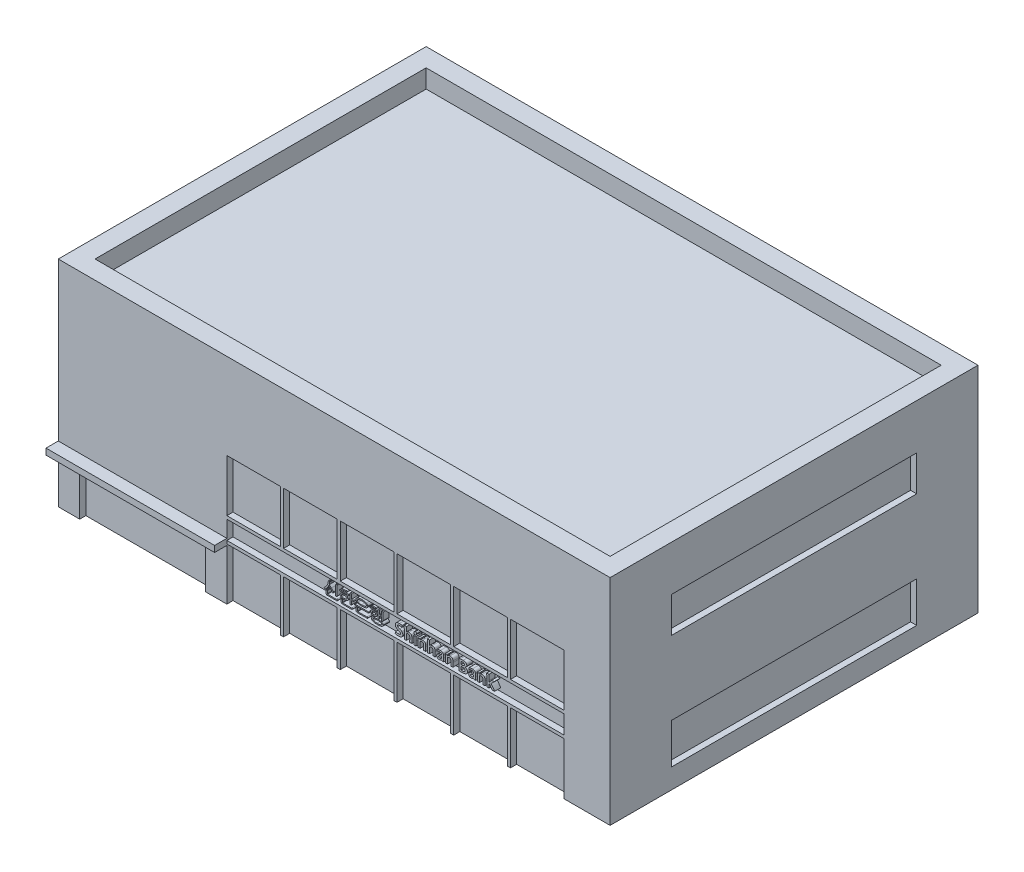
from build123d import *

# Parameters (mm, degrees)
SKETCH1_W           = 90
SKETCH1_H           = 35
BOSS_EXTRUDE1_DEPTH = 60
SKETCH2_W           = 27.497471235
SKETCH2_H           = 1
BOSS_EXTRUDE2_DEPTH = 2
SKETCH3_W           = 8.75
SKETCH3_H           = 8.5
SKETCH3_W_2         = 20.497471235
SKETCH3_H_2         = 8.294393038
CUT_EXTRUDE1_DEPTH  = 1
SKETCH4_W           = 40
SKETCH4_H           = 5.788875943
SKETCH4_H_2         = 6.584846385
CUT_EXTRUDE2_DEPTH  = 1
SKETCH5_W           = 84
SKETCH5_H           = 54
CUT_EXTRUDE3_DEPTH  = 29
SKETCH6_W           = 84
SKETCH6_H           = 54
CUT_EXTRUDE4_DEPTH  = 3
BOSS_EXTRUDE3_DEPTH = 1


with BuildPart() as part:
    # Sketch1 → Boss-Extrude1 (new body)
    with BuildSketch(Plane.XY):
        with Locations((45, 17.5)):
            Rectangle(SKETCH1_W, SKETCH1_H)
    extrude(amount=BOSS_EXTRUDE1_DEPTH)

    # Sketch2 → Boss-Extrude2 (add)
    with BuildSketch(Plane.XY.offset(60)):
        with Locations((13.748735618, 8.794393038)):
            Rectangle(SKETCH2_W, SKETCH2_H)
    extrude(amount=BOSS_EXTRUDE2_DEPTH)

    # Sketch3 → Cut-Extrude1 (cut)
    with BuildSketch(Plane.XY.offset(60)):
        with Locations((31.872471235, 16.75)):
            Rectangle(SKETCH3_W, SKETCH3_H)
        with Locations((41.122471235, 16.75)):
            Rectangle(SKETCH3_W, SKETCH3_H)
        with Locations((50.372471235, 16.75)):
            Rectangle(SKETCH3_W, SKETCH3_H)
        with Locations((59.622471235, 16.75)):
            Rectangle(SKETCH3_W, SKETCH3_H)
        with Locations((68.872471235, 16.75)):
            Rectangle(SKETCH3_W, SKETCH3_H)
        with Locations((78.122471235, 16.75)):
            Rectangle(SKETCH3_W, SKETCH3_H)
        Polygon((27.497471235, 9.294393038), (27.497471235, 9), (36.247471235, 9), (36.747471235, 9), (45.497471235, 9), (45.997471235, 9), (54.747471235, 9), (55.247471235, 9), (63.997471235, 9), (64.497471235, 9), (73.247471235, 9), (73.747471235, 9), (82.497471235, 9), (82.497471235, 12), (73.747471235, 12), (73.247471235, 12), (64.497471235, 12), (63.997471235, 12), (55.247471235, 12), (54.747471235, 12), (45.997471235, 12), (45.497471235, 12), (36.747471235, 12), (36.247471235, 12), (27.497471235, 12), align=None)
        with Locations((78.122471235, 4.25)):
            Rectangle(SKETCH3_W, SKETCH3_H)
        with Locations((68.872471235, 4.25)):
            Rectangle(SKETCH3_W, SKETCH3_H)
        with Locations((59.622471235, 4.25)):
            Rectangle(SKETCH3_W, SKETCH3_H)
        with Locations((50.372471235, 4.25)):
            Rectangle(SKETCH3_W, SKETCH3_H)
        with Locations((41.122471235, 4.25)):
            Rectangle(SKETCH3_W, SKETCH3_H)
        Polygon((27.497471235, 8.5), (27.497471235, 8.294393038), (27.497471235, 0), (36.247471235, 0), (36.247471235, 8.5), align=None)
        with Locations((13.748735618, 4.147196519)):
            Rectangle(SKETCH3_W_2, SKETCH3_H_2)
    extrude(amount=-CUT_EXTRUDE1_DEPTH, mode=Mode.SUBTRACT)

    # Sketch4 → Cut-Extrude2 (cut)
    with BuildSketch(Plane(origin=(90, 0, 0), x_dir=(0, 0, -1), z_dir=(1, 0, 0))):
        with Locations((-30, 24.724177347)):
            Rectangle(SKETCH4_W, SKETCH4_H)
        with Locations((-30, 6.537316183)):
            Rectangle(SKETCH4_W, SKETCH4_H_2)
    extrude(amount=-CUT_EXTRUDE2_DEPTH, mode=Mode.SUBTRACT)

    # Sketch5 → Cut-Extrude3 (cut)
    with BuildSketch(Plane.XZ):
        with Locations((45, 30)):
            Rectangle(SKETCH5_W, SKETCH5_H)
    extrude(amount=-CUT_EXTRUDE3_DEPTH, mode=Mode.SUBTRACT)

    # Sketch6 → Cut-Extrude4 (cut)
    with BuildSketch(Plane(origin=(0, 35, 0), x_dir=(1, 0, 0), z_dir=(0, 1, 0))):
        with Locations((45, -30)):
            Rectangle(SKETCH6_W, SKETCH6_H)
    extrude(amount=-CUT_EXTRUDE4_DEPTH, mode=Mode.SUBTRACT)

    # Sketch7 → Boss-Extrude3 (add)
    # profile 1 of 28: a face of its own
    with BuildSketch(Plane.XY.offset(59)):
        with BuildLine():
            add(Edge.make_bspline(
                [(44.033548944, 11.520070674), (44.033059078, 11.496140982), (44.032068775, 11.447765166), (44.024507351, 11.374612014), (44.011712904, 11.300331378), (43.994130713, 11.224800352), (43.97149247, 11.14798106), (43.944319058, 11.06977643), (43.911561206, 10.990543247), (43.886512672, 10.938164587), (43.873766336, 10.911510891)],
                knots=[0, 0, 0, 0, 0.90479167, 1.829109886, 2.777671084, 3.753516118, 4.759923808, 5.804733558, 6.882904537, 8, 8, 8, 8], degree=3))
            add(Edge.make_bspline(
                [(43.873766336, 10.911510891), (43.859117849, 10.882548514), (43.830258173, 10.825488366), (43.782278986, 10.74351405), (43.730745002, 10.66622627), (43.676886598, 10.592463879), (43.618561237, 10.524092105), (43.557905122, 10.459451196), (43.493938893, 10.39919264), (43.448471642, 10.362713514), (43.425804379, 10.344527195)],
                knots=[0, 0, 0, 0, 1.068400126, 2.104905605, 3.124741684, 4.125893929, 5.109900006, 6.081391191, 7.043495968, 8, 8, 8, 8], degree=3))
            add(Edge.make_bspline(
                [(43.425804379, 10.344527195), (43.419045937, 10.339911868), (43.405982635, 10.330990964), (43.39075087, 10.313412612), (43.379543568, 10.293893288), (43.37614926, 10.279569467), (43.374445683, 10.272380456)],
                knots=[0, 0, 0, 0, 1.072359032, 2.072748617, 3.032727926, 4, 4, 4, 4], degree=3))
            add(Edge.make_bspline(
                [(43.374445683, 10.272380456), (43.374281742, 10.26596229), (43.373960444, 10.253383799), (43.378634759, 10.235174474), (43.385100855, 10.217630876), (43.392651115, 10.207689808), (43.396456553, 10.202679369)],
                knots=[0, 0, 0, 0, 1.024832134, 2.008493206, 2.996252381, 4, 4, 4, 4], degree=3))
            add(Edge.make_bspline(
                [(43.396456553, 10.202679369), (43.400961814, 10.198208538), (43.409830609, 10.18940752), (43.425098055, 10.178371943), (43.442499052, 10.171185621), (43.454700139, 10.168277632), (43.460858727, 10.166809804)],
                knots=[0, 0, 0, 0, 1.01402205, 1.996144883, 2.988539498, 4, 4, 4, 4], degree=3))
            add(Edge.make_bspline(
                [(43.460858727, 10.166809804), (43.470111105, 10.166174514), (43.487884207, 10.164954171), (43.513444741, 10.169020469), (43.536932436, 10.175957573), (43.550405677, 10.184297515), (43.557054379, 10.188413065)],
                knots=[0, 0, 0, 0, 1.102551455, 2.117916065, 3.071239438, 4, 4, 4, 4], degree=3))
            add(Edge.make_bspline(
                [(43.557054379, 10.188413065), (43.591314934, 10.216598821), (43.65905573, 10.27232838), (43.752245606, 10.363559683), (43.838767107, 10.458197913), (43.889644277, 10.52602728), (43.914934814, 10.559744587)],
                knots=[0, 0, 0, 0, 1.028744093, 2.03405767, 3.022749559, 4, 4, 4, 4], degree=3))
            add(Edge.make_bspline(
                [(43.914934814, 10.559744587), (43.936394714, 10.590598821), (43.978697194, 10.65141973), (44.034307732, 10.745759159), (44.083092698, 10.840472362), (44.109674449, 10.905194554), (44.122815249, 10.937190239)],
                knots=[0, 0, 0, 0, 1.043636145, 2.057250825, 3.039593849, 4, 4, 4, 4], degree=3))
            add(Edge.make_bspline(
                [(44.122815249, 10.937190239), (44.142479059, 10.915281441), (44.183149556, 10.869967654), (44.24691726, 10.80041785), (44.314527199, 10.726060614), (44.361243044, 10.675212442), (44.385315249, 10.649010891)],
                knots=[0, 0, 0, 0, 0.906243597, 1.87437621, 2.904687455, 4, 4, 4, 4], degree=3))
            add(Edge.make_bspline(
                [(44.385315249, 10.649010891), (44.41124586, 10.619877352), (44.462362483, 10.562446846), (44.533580821, 10.473875632), (44.599237083, 10.38516528), (44.63860711, 10.324354129), (44.658005466, 10.294391326)],
                knots=[0, 0, 0, 0, 1.044776838, 2.059552824, 3.043905033, 4, 4, 4, 4], degree=3))
            add(Edge.make_bspline(
                [(44.658005466, 10.294391326), (44.662620781, 10.28750204), (44.671642573, 10.274035199), (44.689437017, 10.258247814), (44.709294244, 10.246072285), (44.723904417, 10.241633721), (44.731375031, 10.239364152)],
                knots=[0, 0, 0, 0, 1.053740651, 2.05980083, 3.007918777, 4, 4, 4, 4], degree=3))
            add(Edge.make_bspline(
                [(44.731375031, 10.239364152), (44.739397409, 10.238656455), (44.755202984, 10.237262162), (44.77868031, 10.24039578), (44.801832052, 10.244654777), (44.816245877, 10.25089823), (44.823494596, 10.254038065)],
                knots=[0, 0, 0, 0, 1.020305685, 2.010191909, 2.999324507, 4, 4, 4, 4], degree=3))
            add(Edge.make_bspline(
                [(44.823494596, 10.254038065), (44.831311638, 10.259644939), (44.84562705, 10.269912854), (44.862538281, 10.28740292), (44.875152083, 10.304124118), (44.878562836, 10.316392021), (44.880152205, 10.322108717)],
                knots=[0, 0, 0, 0, 1.270598232, 2.326856882, 3.220335425, 4, 4, 4, 4], degree=3))
            add(Edge.make_bspline(
                [(44.880152205, 10.322108717), (44.88131057, 10.329435164), (44.883603913, 10.343940136), (44.880990249, 10.365892182), (44.875609338, 10.387649947), (44.868376029, 10.400903379), (44.864663075, 10.407706543)],
                knots=[0, 0, 0, 0, 0.995930983, 1.971753846, 2.958874106, 4, 4, 4, 4], degree=3))
            add(Edge.make_bspline(
                [(44.864663075, 10.407706543), (44.842972499, 10.439054642), (44.797768613, 10.504385131), (44.720732078, 10.601555258), (44.632942039, 10.702294051), (44.569156398, 10.768971421), (44.536130466, 10.803494587)],
                knots=[0, 0, 0, 0, 0.887932877, 1.850481882, 2.887056129, 4, 4, 4, 4], degree=3))
            add(Edge.make_bspline(
                [(44.536130466, 10.803494587), (44.509426288, 10.830600237), (44.456070944, 10.884757727), (44.372542821, 10.962281354), (44.287748157, 11.038115431), (44.228857617, 11.085795615), (44.199445683, 11.109608717)],
                knots=[0, 0, 0, 0, 1.002670189, 2.003349891, 3.002805175, 4, 4, 4, 4], degree=3))
            add(Edge.make_bspline(
                [(44.199445683, 11.109608717), (44.203819988, 11.123422152), (44.212931328, 11.15219448), (44.22376849, 11.197662077), (44.234888835, 11.246441114), (44.240271848, 11.28035782), (44.243059814, 11.297923934)],
                knots=[0, 0, 0, 0, 0.898264047, 1.871015279, 2.897357856, 4, 4, 4, 4], degree=3))
            add(Edge.make_bspline(
                [(44.243059814, 11.297923934), (44.246861684, 11.318824835), (44.254174668, 11.359028193), (44.26255649, 11.417172493), (44.267133282, 11.470675576), (44.267945524, 11.504710361), (44.268331553, 11.520885891)],
                knots=[0, 0, 0, 0, 1.134465834, 2.18217083, 3.136050078, 4, 4, 4, 4], degree=3))
            add(Edge.make_bspline(
                [(44.268331553, 11.520885891), (44.267758971, 11.528168138), (44.266585744, 11.543089528), (44.257455107, 11.56445233), (44.242964918, 11.584844147), (44.230021943, 11.596280132), (44.223086988, 11.60240763)],
                knots=[0, 0, 0, 0, 0.905111684, 1.854581983, 2.850466793, 4, 4, 4, 4], degree=3))
            add(Edge.make_bspline(
                [(44.223086988, 11.60240763), (44.217935625, 11.606322805), (44.207036652, 11.614606319), (44.186705598, 11.622452117), (44.162816278, 11.626806781), (44.145798976, 11.627374791), (44.136673944, 11.627679369)],
                knots=[0, 0, 0, 0, 0.841293685, 1.779963655, 2.809570262, 4, 4, 4, 4], degree=3))
            add(Edge.make_bspline(
                [(44.136673944, 11.627679369), (44.129978583, 11.6273962), (44.116940649, 11.626844783), (44.098205616, 11.621625221), (44.080793415, 11.613719426), (44.071032086, 11.605631316), (44.06615764, 11.601592413)],
                knots=[0, 0, 0, 0, 1.042390735, 2.029856377, 3.016183204, 4, 4, 4, 4], degree=3))
            add(Edge.make_bspline(
                [(44.06615764, 11.601592413), (44.061102536, 11.596520395), (44.050911968, 11.586295729), (44.040966209, 11.566531149), (44.034497044, 11.5442577), (44.03387588, 11.528411139), (44.033548944, 11.520070674)],
                knots=[0, 0, 0, 0, 0.944508968, 1.904032748, 2.896836952, 4, 4, 4, 4], degree=3))
        make_face()
    # profile 2 of 28: a face of its own
    with BuildSketch(Plane.XY.offset(59)):
        with BuildLine():
            Line((45.442244596, 10.0962935), (45.442244596, 11.581211978))
            add(Edge.make_bspline(
                [(45.442244596, 11.581211978), (45.441684107, 11.587829132), (45.440539336, 11.601344324), (45.430997138, 11.620832168), (45.416125911, 11.63919392), (45.403077812, 11.649529246), (45.396184814, 11.654989152)],
                knots=[0, 0, 0, 0, 0.87701776, 1.791263171, 2.833177144, 4, 4, 4, 4], degree=3))
            add(Edge.make_bspline(
                [(45.396184814, 11.654989152), (45.391326389, 11.658937068), (45.381090727, 11.667254486), (45.36122573, 11.674569405), (45.337835815, 11.679037962), (45.32094085, 11.679567233), (45.311809814, 11.679853282)],
                knots=[0, 0, 0, 0, 0.830200477, 1.749055086, 2.783456524, 4, 4, 4, 4], degree=3))
            add(Edge.make_bspline(
                [(45.311809814, 11.679853282), (45.304843403, 11.679570498), (45.291271303, 11.679019573), (45.272038924, 11.673872393), (45.254144965, 11.66626641), (45.24425763, 11.658236431), (45.239255466, 11.654173934)],
                knots=[0, 0, 0, 0, 1.060439937, 2.065970274, 3.021542859, 4, 4, 4, 4], degree=3))
            add(Edge.make_bspline(
                [(45.239255466, 11.654173934), (45.234352301, 11.649224978), (45.224629662, 11.639411538), (45.215020252, 11.620819164), (45.208448188, 11.600405658), (45.207798817, 11.585888688), (45.207461988, 11.578358717)],
                knots=[0, 0, 0, 0, 0.982558223, 1.948345407, 2.935804201, 4, 4, 4, 4], degree=3))
            Line((45.207461988, 11.578358717), (45.207461988, 10.0962935))
            add(Edge.make_bspline(
                [(45.207461988, 10.0962935), (45.207849775, 10.08810269), (45.208596863, 10.072322739), (45.214391925, 10.050048539), (45.223855913, 10.029994187), (45.233274772, 10.019068145), (45.23803264, 10.013548934)],
                knots=[0, 0, 0, 0, 1.086136308, 2.092488787, 3.036434566, 4, 4, 4, 4], degree=3))
            add(Edge.make_bspline(
                [(45.23803264, 10.013548934), (45.242893503, 10.009117196), (45.252665044, 10.000208304), (45.270493918, 9.990763695), (45.290588761, 9.985475978), (45.304577354, 9.984635603), (45.311809814, 9.984201108)],
                knots=[0, 0, 0, 0, 0.965404326, 1.940702037, 2.935290319, 4, 4, 4, 4], degree=3))
            add(Edge.make_bspline(
                [(45.311809814, 9.984201108), (45.321374052, 9.984363389), (45.339342706, 9.984668272), (45.363789584, 9.990766596), (45.385018418, 9.998641821), (45.395323365, 10.008168893), (45.400260901, 10.012733717)],
                knots=[0, 0, 0, 0, 1.198138482, 2.250982859, 3.161971825, 4, 4, 4, 4], degree=3))
            add(Edge.make_bspline(
                [(45.400260901, 10.012733717), (45.406666055, 10.019160436), (45.41886787, 10.031403331), (45.431872405, 10.052646986), (45.440981586, 10.074110164), (45.44182975, 10.0890072), (45.442244596, 10.0962935)],
                knots=[0, 0, 0, 0, 1.128609039, 2.149999564, 3.095145075, 4, 4, 4, 4], degree=3))
        make_face()
    # profile 3 of 28: a face of its own
    with BuildSketch(Plane.XY.offset(59)):
        with BuildLine():
            add(Edge.make_bspline(
                [(43.877027205, 10.073875021), (43.876570481, 10.081682092), (43.875642526, 10.097544212), (43.867421218, 10.120653865), (43.854046063, 10.142797767), (43.841840557, 10.155615943), (43.835451118, 10.162326108)],
                knots=[0, 0, 0, 0, 0.930526552, 1.890609816, 2.895758926, 4, 4, 4, 4], degree=3))
            add(Edge.make_bspline(
                [(43.835451118, 10.162326108), (43.830379306, 10.167135428), (43.819933754, 10.17704037), (43.798789597, 10.186175399), (43.774077666, 10.191850056), (43.756142774, 10.19253306), (43.746592423, 10.19289676)],
                knots=[0, 0, 0, 0, 0.862219525, 1.775767607, 2.815593677, 4, 4, 4, 4], degree=3))
            add(Edge.make_bspline(
                [(43.746592423, 10.19289676), (43.739340926, 10.192526984), (43.725409293, 10.191816567), (43.705659467, 10.185705088), (43.687543826, 10.176447723), (43.677776168, 10.167082589), (43.672815249, 10.162326108)],
                knots=[0, 0, 0, 0, 1.057464038, 2.031608183, 3.000268724, 4, 4, 4, 4], degree=3))
            add(Edge.make_bspline(
                [(43.672815249, 10.162326108), (43.668044099, 10.15667394), (43.658508299, 10.145377303), (43.649117157, 10.124445591), (43.643358705, 10.100956251), (43.642626885, 10.0842385), (43.642244596, 10.075505456)],
                knots=[0, 0, 0, 0, 0.937684764, 1.874092027, 2.889464948, 4, 4, 4, 4], degree=3))
            Line((43.642244596, 10.075505456), (43.642244596, 9.708250021))
            add(Edge.make_bspline(
                [(43.642244596, 9.708250021), (43.642419989, 9.697365192), (43.642758979, 9.676327515), (43.647065316, 9.645777288), (43.653576924, 9.617138832), (43.662247478, 9.590153255), (43.674451683, 9.565454124), (43.688613178, 9.542408736), (43.705822915, 9.521479005), (43.719130006, 9.50932092), (43.725804379, 9.503222847)],
                knots=[0, 0, 0, 0, 1.140942192, 2.205158444, 3.228510247, 4.220006747, 5.169755849, 6.110911703, 7.052499082, 8, 8, 8, 8], degree=3))
            add(Edge.make_bspline(
                [(43.725804379, 9.503222847), (43.739265099, 9.492777794), (43.766684232, 9.471501494), (43.816689014, 9.4513743), (43.872664402, 9.438202545), (43.912400641, 9.437004466), (43.933277205, 9.436375021)],
                knots=[0, 0, 0, 0, 0.914397999, 1.862604627, 2.877058463, 4, 4, 4, 4], degree=3))
            Line((43.933277205, 9.436375021), (45.401483727, 9.436375021))
            add(Edge.make_bspline(
                [(45.401483727, 9.436375021), (45.410732065, 9.436742513), (45.428238987, 9.437438168), (45.452821142, 9.441092081), (45.473686399, 9.448510201), (45.490930989, 9.458749322), (45.504409455, 9.472170765), (45.51411322, 9.488528022), (45.519277392, 9.507951134), (45.52008169, 9.521672534), (45.520505466, 9.528902195)],
                knots=[0, 0, 0, 0, 1.292319837, 2.446335976, 3.454528254, 4.365575023, 5.224145591, 6.08313528, 6.990024257, 8, 8, 8, 8], degree=3))
            add(Edge.make_bspline(
                [(45.520505466, 9.528902195), (45.520082613, 9.535996732), (45.519280614, 9.549452491), (45.514110136, 9.568482339), (45.504390241, 9.58444084), (45.49089056, 9.59742749), (45.473652959, 9.60730826), (45.452695487, 9.614017724), (45.42831235, 9.618613952), (45.410747156, 9.618856044), (45.401483727, 9.618983717)],
                knots=[0, 0, 0, 0, 1.001154286, 1.89882603, 2.750087126, 3.603933028, 4.514401734, 5.52650191, 6.695541121, 8, 8, 8, 8], degree=3))
            Line((45.401483727, 9.618983717), (43.956103292, 9.618983717))
            add(Edge.make_bspline(
                [(43.956103292, 9.618983717), (43.94833319, 9.619182379), (43.934207153, 9.619543546), (43.915091395, 9.622895975), (43.899320526, 9.62754109), (43.891573539, 9.633697153), (43.88803264, 9.636510891)],
                knots=[0, 0, 0, 0, 1.297233898, 2.358369767, 3.249663631, 4, 4, 4, 4], degree=3))
            add(Edge.make_bspline(
                [(43.88803264, 9.636510891), (43.886218959, 9.639708001), (43.881382476, 9.648233629), (43.879662132, 9.666575388), (43.877286455, 9.691713012), (43.877121294, 9.711077322), (43.877027205, 9.722108717)],
                knots=[0, 0, 0, 0, 0.502056024, 1.338816065, 2.483985693, 4, 4, 4, 4], degree=3))
            Line((43.877027205, 9.722108717), (43.877027205, 10.073875021))
        make_face()
    # profile 4 of 28: a face of its own
    with BuildSketch(Plane.XY.offset(59)):
        with BuildLine():
            Line((46.983820683, 11.627679369), (46.274581553, 11.627679369))
            add(Edge.make_bspline(
                [(46.274581553, 11.627679369), (46.266530843, 11.627579162), (46.251503353, 11.627392115), (46.230685066, 11.622566161), (46.212737764, 11.615962984), (46.198027885, 11.605800368), (46.186145395, 11.593041129), (46.178508891, 11.576783842), (46.173427269, 11.558150897), (46.172937897, 11.544702285), (46.172679379, 11.537597847)],
                knots=[0, 0, 0, 0, 1.237414559, 2.309763231, 3.278278247, 4.167191465, 5.04217569, 5.932075494, 6.907586748, 8, 8, 8, 8], degree=3))
            add(Edge.make_bspline(
                [(46.172679379, 11.537597847), (46.172938509, 11.530358428), (46.173429412, 11.516643875), (46.17851229, 11.497610976), (46.186130674, 11.480963936), (46.19799685, 11.467773109), (46.212705527, 11.457258542), (46.230541185, 11.449945465), (46.251590004, 11.446047744), (46.266548901, 11.445412037), (46.274581553, 11.445070674)],
                knots=[0, 0, 0, 0, 1.100584403, 2.084977019, 2.983282269, 3.863749791, 4.754385271, 5.719644564, 6.775491106, 8, 8, 8, 8], degree=3))
            Line((46.274581553, 11.445070674), (46.989119596, 11.445070674))
            add(Edge.make_bspline(
                [(46.989119596, 11.445070674), (46.99891568, 11.445418171), (47.017243144, 11.446068304), (47.042974208, 11.449899924), (47.064788522, 11.457002418), (47.082548057, 11.467485775), (47.096612685, 11.480607203), (47.105756061, 11.497485379), (47.111163927, 11.516877558), (47.111320565, 11.530766451), (47.111402205, 11.538005456)],
                knots=[0, 0, 0, 0, 1.334286443, 2.496312469, 3.531997261, 4.436386688, 5.286931403, 6.115454444, 7.017759367, 8, 8, 8, 8], degree=3))
            add(Edge.make_bspline(
                [(47.111402205, 11.538005456), (47.111029298, 11.545109916), (47.110326787, 11.558493845), (47.10452892, 11.577452842), (47.093989004, 11.593179213), (47.079628922, 11.606260935), (47.061110655, 11.616066849), (47.038793398, 11.622626003), (47.012686308, 11.627388333), (46.993901146, 11.627577733), (46.983820683, 11.627679369)],
                knots=[0, 0, 0, 0, 0.961490639, 1.811330099, 2.648519146, 3.495363743, 4.417835567, 5.459810592, 6.636887789, 8, 8, 8, 8], degree=3))
        make_face()
    # profile 5 of 28: a face of its own
    with BuildSketch(Plane.XY.offset(59)):
        with BuildLine():
            Line((47.268331553, 11.288548934), (45.987217423, 11.288548934))
            add(Edge.make_bspline(
                [(45.987217423, 11.288548934), (45.979304789, 11.288427657), (45.964283998, 11.288197432), (45.943457652, 11.283476889), (45.925250874, 11.27688201), (45.910783626, 11.266349071), (45.899080336, 11.253307275), (45.891638595, 11.236934686), (45.886419138, 11.218079748), (45.885964938, 11.204488488), (45.885722857, 11.197244587)],
                knots=[0, 0, 0, 0, 1.210846206, 2.298585645, 3.262602585, 4.159342867, 5.016428405, 5.920891029, 6.891871714, 8, 8, 8, 8], degree=3))
            add(Edge.make_bspline(
                [(45.885722857, 11.197244587), (45.886002789, 11.190148783), (45.886537887, 11.17658496), (45.891421121, 11.157718927), (45.899365515, 11.141534527), (45.910478018, 11.128055455), (45.925519303, 11.118232178), (45.94326585, 11.110705978), (45.96438299, 11.106998957), (45.979326967, 11.10630608), (45.987217423, 11.105940239)],
                knots=[0, 0, 0, 0, 1.088774334, 2.081222062, 2.968157536, 3.842223845, 4.72817602, 5.70133386, 6.786298825, 8, 8, 8, 8], degree=3))
            Line((45.987217423, 11.105940239), (47.271184814, 11.105940239))
            add(Edge.make_bspline(
                [(47.271184814, 11.105940239), (47.281140679, 11.106152954), (47.299723144, 11.106549983), (47.325267718, 11.111961621), (47.347098192, 11.120125714), (47.358327757, 11.12927218), (47.363711988, 11.13365763)],
                knots=[0, 0, 0, 0, 1.206349756, 2.251632946, 3.161711732, 4, 4, 4, 4], degree=3))
            add(Edge.make_bspline(
                [(47.363711988, 11.13365763), (47.369055944, 11.139217513), (47.378953243, 11.149514722), (47.390147351, 11.165961361), (47.397469765, 11.181715354), (47.39835268, 11.192290163), (47.398766336, 11.197244587)],
                knots=[0, 0, 0, 0, 1.241573706, 2.299462631, 3.203278136, 4, 4, 4, 4], degree=3))
            add(Edge.make_bspline(
                [(47.398766336, 11.197244587), (47.398233901, 11.202613241), (47.397097269, 11.214074153), (47.389160191, 11.230744428), (47.37678244, 11.24763857), (47.365954564, 11.257754694), (47.36004351, 11.263277195)],
                knots=[0, 0, 0, 0, 0.817632386, 1.745467848, 2.769226697, 4, 4, 4, 4], degree=3))
            add(Edge.make_bspline(
                [(47.36004351, 11.263277195), (47.354756046, 11.267198911), (47.343466589, 11.275572312), (47.322032113, 11.283482827), (47.296489641, 11.287628761), (47.278131764, 11.288228675), (47.268331553, 11.288548934)],
                knots=[0, 0, 0, 0, 0.810677628, 1.730907744, 2.788662629, 4, 4, 4, 4], degree=3))
        make_face()
    # profile 6 of 28: a face of its own
    with BuildSketch(Plane.XY.offset(59)):
        with BuildLine():
            add(Edge.make_bspline(
                [(46.632054379, 11.001592413), (46.606368458, 11.001138181), (46.556300119, 11.000252769), (46.483169925, 10.99520399), (46.41423303, 10.985595398), (46.349274768, 10.973392774), (46.288656224, 10.956578371), (46.232353229, 10.936060783), (46.179556247, 10.912863751), (46.147357819, 10.893381814), (46.131510901, 10.8837935)],
                knots=[0, 0, 0, 0, 1.183363672, 2.306674304, 3.374195158, 4.388113484, 5.349332707, 6.268019932, 7.147581139, 8, 8, 8, 8], degree=3))
            add(Edge.make_bspline(
                [(46.131510901, 10.8837935), (46.118262666, 10.874133112), (46.09242231, 10.855290764), (46.058146468, 10.823516693), (46.029214611, 10.789680749), (46.005285743, 10.754098275), (45.986788534, 10.716364296), (45.973843742, 10.676835483), (45.965092002, 10.635671192), (45.964356926, 10.607480809), (45.963983727, 10.5931685)],
                knots=[0, 0, 0, 0, 1.124017489, 2.192368311, 3.197201582, 4.17171064, 5.126226719, 6.069345046, 7.019802925, 8, 8, 8, 8], degree=3))
            add(Edge.make_bspline(
                [(45.963983727, 10.5931685), (45.964366615, 10.579263752), (45.965124312, 10.5517477), (45.973800126, 10.511651608), (45.986701002, 10.473284193), (46.005457419, 10.437043229), (46.029211114, 10.402591118), (46.058504241, 10.370425699), (46.092662402, 10.339755847), (46.118518655, 10.321957571), (46.13191851, 10.312733717)],
                knots=[0, 0, 0, 0, 0.974849299, 1.929125462, 2.867481879, 3.810483173, 4.784398261, 5.797796819, 6.858720869, 8, 8, 8, 8], degree=3))
            add(Edge.make_bspline(
                [(46.13191851, 10.312733717), (46.147646314, 10.303055716), (46.179637936, 10.283369882), (46.231835878, 10.258985004), (46.288268736, 10.23873093), (46.348839952, 10.222204748), (46.413431455, 10.208553755), (46.482507442, 10.199355507), (46.555888349, 10.194215413), (46.606231073, 10.193343836), (46.632054379, 10.19289676)],
                knots=[0, 0, 0, 0, 0.849509468, 1.727970648, 2.645950625, 3.606429856, 4.615912619, 5.682611646, 6.811295338, 8, 8, 8, 8], degree=3))
            add(Edge.make_bspline(
                [(46.632054379, 10.19289676), (46.658285392, 10.193340013), (46.70930709, 10.194202179), (46.783769955, 10.199380755), (46.853927777, 10.208565508), (46.919621717, 10.222152051), (46.981127185, 10.238738675), (47.038371513, 10.258984867), (47.091380057, 10.283367251), (47.123932674, 10.303055442), (47.139934814, 10.312733717)],
                knots=[0, 0, 0, 0, 1.190473723, 2.315579302, 3.385604058, 4.39899987, 5.357857087, 6.274526943, 7.151795969, 8, 8, 8, 8], degree=3))
            add(Edge.make_bspline(
                [(47.139934814, 10.312733717), (47.154257244, 10.322530605), (47.181870223, 10.341418548), (47.218839257, 10.372998472), (47.250247728, 10.406057729), (47.275429586, 10.440950365), (47.296167561, 10.476566219), (47.309852707, 10.514287566), (47.318920403, 10.553200292), (47.319975392, 10.579802397), (47.320505466, 10.5931685)],
                knots=[0, 0, 0, 0, 1.194429404, 2.302804204, 3.342193088, 4.326719744, 5.261094001, 6.170149216, 7.080600129, 8, 8, 8, 8], degree=3))
            add(Edge.make_bspline(
                [(47.320505466, 10.5931685), (47.319940519, 10.606798314), (47.318817413, 10.633894199), (47.310266003, 10.673773389), (47.296919055, 10.712437795), (47.277390161, 10.749313373), (47.252710466, 10.78459737), (47.222503618, 10.818253823), (47.186902067, 10.850518287), (47.160234067, 10.87003967), (47.146456553, 10.880125021)],
                knots=[0, 0, 0, 0, 0.93445478, 1.857683346, 2.78635486, 3.73282112, 4.710315416, 5.733713136, 6.829166027, 8, 8, 8, 8], degree=3))
            add(Edge.make_bspline(
                [(47.146456553, 10.880125021), (47.1299223, 10.889971846), (47.096448077, 10.909907115), (47.04185134, 10.934104504), (46.983784572, 10.955367651), (46.921347909, 10.972527615), (46.854809534, 10.985336197), (46.784167438, 10.994621218), (46.709460007, 11.000407458), (46.658287899, 11.00119082), (46.632054379, 11.001592413)],
                knots=[0, 0, 0, 0, 0.861892305, 1.744933662, 2.671607722, 3.631989252, 4.643621886, 5.706476987, 6.824219182, 8, 8, 8, 8], degree=3))
        make_face()
        with BuildLine():
            add(Edge.make_bspline(
                [(46.632054379, 10.818983717), (46.650130257, 10.818733948), (46.68522517, 10.818249013), (46.736363999, 10.814935847), (46.784389242, 10.809721148), (46.829354676, 10.802543717), (46.871213977, 10.792825756), (46.909740035, 10.780417472), (46.945655901, 10.767014322), (46.967489058, 10.75536122), (46.978114162, 10.749690239)],
                knots=[0, 0, 0, 0, 1.216540896, 2.361954268, 3.447545542, 4.466829851, 5.425051079, 6.336075199, 7.190251141, 8, 8, 8, 8], degree=3))
            add(Edge.make_bspline(
                [(46.978114162, 10.749690239), (46.986618439, 10.74466071), (47.002981741, 10.734983261), (47.025411242, 10.718802924), (47.043678202, 10.700628652), (47.059288849, 10.681742462), (47.070969735, 10.66125194), (47.079937416, 10.639707542), (47.084757517, 10.616751325), (47.085399471, 10.60106869), (47.085722857, 10.5931685)],
                knots=[0, 0, 0, 0, 1.184388595, 2.278913026, 3.303976868, 4.265478187, 5.206905364, 6.12030076, 7.053094054, 8, 8, 8, 8], degree=3))
            add(Edge.make_bspline(
                [(47.085722857, 10.5931685), (47.085423824, 10.585802258), (47.084835452, 10.571308549), (47.079663443, 10.549950559), (47.071222921, 10.529655273), (47.058843413, 10.510563658), (47.043859948, 10.49217085), (47.025103909, 10.474918269), (47.00302563, 10.458645991), (46.986633448, 10.448997958), (46.978114162, 10.443983717)],
                knots=[0, 0, 0, 0, 0.912190638, 1.794812748, 2.708402334, 3.624473661, 4.605904153, 5.642873528, 6.774962591, 8, 8, 8, 8], degree=3))
            add(Edge.make_bspline(
                [(46.978114162, 10.443983717), (46.967472063, 10.438485253), (46.945547001, 10.427157207), (46.909940887, 10.413607892), (46.871421737, 10.401728507), (46.829772261, 10.391914621), (46.784793824, 10.38477863), (46.73663803, 10.379529279), (46.685359844, 10.376254236), (46.650129943, 10.375759363), (46.632054379, 10.375505456)],
                knots=[0, 0, 0, 0, 0.806306134, 1.661167839, 2.561460097, 3.520450618, 4.540553245, 5.62701607, 6.782482422, 8, 8, 8, 8], degree=3))
            add(Edge.make_bspline(
                [(46.632054379, 10.375505456), (46.614658194, 10.37576251), (46.580650224, 10.376265028), (46.531134246, 10.379515281), (46.484345153, 10.384835676), (46.440318351, 10.391950048), (46.399079881, 10.401769772), (46.360594581, 10.413707006), (46.324581668, 10.42708274), (46.302464859, 10.438725206), (46.291701118, 10.444391326)],
                knots=[0, 0, 0, 0, 1.190343221, 2.327013562, 3.393740876, 4.411667212, 5.37681079, 6.291373214, 7.168450748, 8, 8, 8, 8], degree=3))
            add(Edge.make_bspline(
                [(46.291701118, 10.444391326), (46.284395153, 10.448715457), (46.270089531, 10.457182428), (46.251004117, 10.47219268), (46.234755511, 10.488716942), (46.221533981, 10.506833978), (46.211371358, 10.526528873), (46.203832807, 10.547460479), (46.19985484, 10.569922695), (46.199135994, 10.58527417), (46.198766336, 10.5931685)],
                knots=[0, 0, 0, 0, 1.10068762, 2.155228288, 3.140123552, 4.099279049, 5.053398721, 6.006866672, 6.97505275, 8, 8, 8, 8], degree=3))
            add(Edge.make_bspline(
                [(46.198766336, 10.5931685), (46.199129007, 10.601606728), (46.199829492, 10.617904822), (46.203845612, 10.641697617), (46.211264115, 10.66376727), (46.221551078, 10.684339877), (46.234686314, 10.703471558), (46.251385063, 10.720343866), (46.270005961, 10.736779069), (46.284603743, 10.745306257), (46.292108727, 10.749690239)],
                knots=[0, 0, 0, 0, 1.05531807, 2.038303988, 3.005160947, 3.954704159, 4.906523546, 5.891708376, 6.916089042, 8, 8, 8, 8], degree=3))
            add(Edge.make_bspline(
                [(46.292108727, 10.749690239), (46.303016851, 10.755339093), (46.325203727, 10.766828735), (46.361282564, 10.780450479), (46.399706886, 10.792760466), (46.441012612, 10.802465936), (46.484879389, 10.809704658), (46.531409405, 10.814941704), (46.58078456, 10.81824061), (46.614657774, 10.81873157), (46.632054379, 10.818983717)],
                knots=[0, 0, 0, 0, 0.840625428, 1.709813088, 2.636848004, 3.602853896, 4.612512165, 5.680192554, 6.808593258, 8, 8, 8, 8], degree=3))
        make_face(mode=Mode.SUBTRACT)
    # profile 7 of 28: a face of its own
    with BuildSketch(Plane.XY.offset(59)):
        with BuildLine():
            Line((47.842244596, 10.87115763), (47.842244596, 11.581619587))
            add(Edge.make_bspline(
                [(47.842244596, 11.581619587), (47.841901507, 11.589277539), (47.841245706, 11.603915368), (47.834929616, 11.624425203), (47.824653524, 11.642245541), (47.809402241, 11.656243169), (47.790299628, 11.667086993), (47.767310529, 11.67460544), (47.740235632, 11.678990898), (47.720931133, 11.679552404), (47.710586988, 11.679853282)],
                knots=[0, 0, 0, 0, 0.979921152, 1.873074941, 2.724971687, 3.588027967, 4.493846446, 5.524533214, 6.673543046, 8, 8, 8, 8], degree=3))
            add(Edge.make_bspline(
                [(47.710586988, 11.679853282), (47.702557168, 11.679522335), (47.687310174, 11.678893933), (47.66588714, 11.674741212), (47.647885332, 11.666656611), (47.63242308, 11.65617509), (47.62159149, 11.641201353), (47.613047108, 11.624079588), (47.608258151, 11.60360605), (47.607738157, 11.588979926), (47.607461988, 11.581211978)],
                knots=[0, 0, 0, 0, 1.179423374, 2.239485065, 3.177086042, 4.062763047, 4.94438865, 5.854213835, 6.860370961, 8, 8, 8, 8], degree=3))
            Line((47.607461988, 11.581211978), (47.607461988, 10.090994587))
            add(Edge.make_bspline(
                [(47.607461988, 10.090994587), (47.607804618, 10.083197076), (47.608465574, 10.06815516), (47.614927863, 10.047027396), (47.624617257, 10.027928555), (47.634352698, 10.017822917), (47.639255466, 10.012733717)],
                knots=[0, 0, 0, 0, 1.073934206, 2.071690363, 3.028903199, 4, 4, 4, 4], degree=3))
            add(Edge.make_bspline(
                [(47.639255466, 10.012733717), (47.64407981, 10.008223944), (47.653597306, 9.999327036), (47.671484481, 9.99117086), (47.690312167, 9.984804276), (47.703734151, 9.984404977), (47.710586988, 9.984201108)],
                knots=[0, 0, 0, 0, 0.997983089, 1.96882724, 2.962947984, 4, 4, 4, 4], degree=3))
            add(Edge.make_bspline(
                [(47.710586988, 9.984201108), (47.720293772, 9.984334863), (47.738277608, 9.98458267), (47.762669745, 9.990857116), (47.783752091, 9.998531309), (47.793837823, 10.008158817), (47.798630466, 10.012733717)],
                knots=[0, 0, 0, 0, 1.219083311, 2.258605404, 3.172505969, 4, 4, 4, 4], degree=3))
            add(Edge.make_bspline(
                [(47.798630466, 10.012733717), (47.805302007, 10.01872824), (47.817882698, 10.030032262), (47.831484279, 10.050048893), (47.840554675, 10.070693503), (47.841682914, 10.085063475), (47.842244596, 10.092217413)],
                knots=[0, 0, 0, 0, 1.146687399, 2.162337027, 3.085139052, 4, 4, 4, 4], degree=3))
            Line((47.842244596, 10.092217413), (47.842244596, 10.688548934))
            Line((47.842244596, 10.688548934), (48.08477177, 10.688548934))
            add(Edge.make_bspline(
                [(48.08477177, 10.688548934), (48.094427028, 10.688907443), (48.112475068, 10.689577584), (48.137740596, 10.69324814), (48.159068764, 10.700797648), (48.176953057, 10.710797791), (48.190993074, 10.72420787), (48.200539838, 10.740784925), (48.206377774, 10.760041419), (48.207088536, 10.773830814), (48.207461988, 10.781076108)],
                knots=[0, 0, 0, 0, 1.325144154, 2.477018662, 3.484830796, 4.411695824, 5.2682728, 6.111983542, 7.00798881, 8, 8, 8, 8], degree=3))
            add(Edge.make_bspline(
                [(48.207461988, 10.781076108), (48.207089279, 10.788186566), (48.206380337, 10.801711632), (48.20053828, 10.820572007), (48.190970554, 10.836752746), (48.176908103, 10.849722804), (48.159040332, 10.859371737), (48.137616508, 10.866209959), (48.112548159, 10.8708257), (48.094442427, 10.871042065), (48.08477177, 10.87115763)],
                knots=[0, 0, 0, 0, 0.983076765, 1.869946721, 2.705836869, 3.55788199, 4.484587052, 5.496247067, 6.662692277, 8, 8, 8, 8], degree=3))
            Line((48.08477177, 10.87115763), (47.842244596, 10.87115763))
        make_face()
    # profile 8 of 28: a face of its own
    with BuildSketch(Plane.XY.offset(59)):
        with BuildLine():
            add(Edge.make_bspline(
                [(46.329201118, 10.031483717), (46.32856169, 10.038471482), (46.327257864, 10.052719876), (46.319157597, 10.073815909), (46.304632093, 10.093419294), (46.292433693, 10.10517147), (46.285994596, 10.111375021)],
                knots=[0, 0, 0, 0, 0.897015657, 1.829058799, 2.854038196, 4, 4, 4, 4], degree=3))
            add(Edge.make_bspline(
                [(46.285994596, 10.111375021), (46.281062955, 10.116068043), (46.270799291, 10.125835093), (46.249620793, 10.13426401), (46.22506277, 10.140218901), (46.207103012, 10.140547789), (46.19754351, 10.140722847)],
                knots=[0, 0, 0, 0, 0.845178526, 1.758973541, 2.807161046, 4, 4, 4, 4], degree=3))
            add(Edge.make_bspline(
                [(46.19754351, 10.140722847), (46.190582705, 10.140287914), (46.177128756, 10.139447267), (46.157808978, 10.134168263), (46.140592757, 10.124477887), (46.13106871, 10.115530216), (46.126211988, 10.110967413)],
                knots=[0, 0, 0, 0, 1.051303601, 2.031975866, 2.996419671, 4, 4, 4, 4], degree=3))
            add(Edge.make_bspline(
                [(46.126211988, 10.110967413), (46.121297309, 10.106025445), (46.111467006, 10.096140558), (46.101901131, 10.077066945), (46.095377537, 10.055826647), (46.094747714, 10.040642958), (46.09441851, 10.032706543)],
                knots=[0, 0, 0, 0, 0.955922253, 1.912028319, 2.908630828, 4, 4, 4, 4], degree=3))
            Line((46.09441851, 10.032706543), (46.09441851, 9.70539676))
            add(Edge.make_bspline(
                [(46.09441851, 9.70539676), (46.095188103, 9.686548938), (46.096671023, 9.650231328), (46.11074803, 9.598348341), (46.133318169, 9.551387181), (46.155503343, 9.525231771), (46.166565249, 9.512190239)],
                knots=[0, 0, 0, 0, 1.068422946, 2.05872952, 3.032049483, 4, 4, 4, 4], degree=3))
            add(Edge.make_bspline(
                [(46.166565249, 9.512190239), (46.179265661, 9.500518982), (46.204731135, 9.477117057), (46.252334499, 9.453695785), (46.305617023, 9.438884161), (46.343358553, 9.437234805), (46.36303264, 9.436375021)],
                knots=[0, 0, 0, 0, 0.952700634, 1.910250861, 2.910645471, 4, 4, 4, 4], degree=3))
            Line((46.36303264, 9.436375021), (47.849581553, 9.436375021))
            add(Edge.make_bspline(
                [(47.849581553, 9.436375021), (47.859239057, 9.436726937), (47.877291295, 9.437384752), (47.902657004, 9.441154137), (47.924185428, 9.448525612), (47.942167634, 9.458632122), (47.95621118, 9.472031863), (47.965757027, 9.488611603), (47.971595223, 9.507867335), (47.972305947, 9.521656842), (47.972679379, 9.528902195)],
                knots=[0, 0, 0, 0, 1.322236743, 2.471583999, 3.49473723, 4.419568685, 5.274266302, 6.116125914, 7.010165316, 8, 8, 8, 8], degree=3))
            add(Edge.make_bspline(
                [(47.972679379, 9.528902195), (47.972306688, 9.536012708), (47.971597779, 9.549537877), (47.965755495, 9.568397547), (47.956188569, 9.584580774), (47.94212302, 9.597541195), (47.924153911, 9.607292628), (47.902534937, 9.613955115), (47.877363728, 9.618669486), (47.859254224, 9.618874314), (47.849581553, 9.618983717)],
                knots=[0, 0, 0, 0, 0.980885708, 1.865779032, 2.699806169, 3.549952274, 4.47459192, 5.501827367, 6.665672834, 8, 8, 8, 8], degree=3))
            Line((47.849581553, 9.618983717), (46.407869596, 9.618983717))
            add(Edge.make_bspline(
                [(46.407869596, 9.618983717), (46.400376762, 9.619202836), (46.386532569, 9.619607693), (46.367637479, 9.622842855), (46.351969433, 9.627706069), (46.343907701, 9.633461129), (46.340206553, 9.636103282)],
                knots=[0, 0, 0, 0, 1.264240463, 2.335883497, 3.23600278, 4, 4, 4, 4], degree=3))
            add(Edge.make_bspline(
                [(46.340206553, 9.636103282), (46.338392804, 9.6391622), (46.333521129, 9.647378362), (46.331822796, 9.66549783), (46.329472809, 9.690350426), (46.329299385, 9.709581415), (46.329201118, 9.720478282)],
                knots=[0, 0, 0, 0, 0.492006716, 1.32151549, 2.482288725, 4, 4, 4, 4], degree=3))
            Line((46.329201118, 9.720478282), (46.329201118, 10.031483717))
        make_face()
    # profile 9 of 28: a face of its own
    with BuildSketch(Plane.XY.offset(59)):
        with BuildLine():
            add(Edge.make_bspline(
                [(49.485722857, 11.653766326), (49.446992289, 11.653393981), (49.371790008, 11.652671008), (49.262576665, 11.646571259), (49.160602396, 11.636356751), (49.065777242, 11.622990977), (48.97834551, 11.604415338), (48.897806619, 11.582824156), (48.824500855, 11.556605376), (48.779448409, 11.534978323), (48.757733727, 11.524554369)],
                knots=[0, 0, 0, 0, 1.24625423, 2.419824068, 3.518312926, 4.543486324, 5.499588457, 6.392674152, 7.225290223, 8, 8, 8, 8], degree=3))
            add(Edge.make_bspline(
                [(48.757733727, 11.524554369), (48.739032816, 11.514187336), (48.702874352, 11.494142538), (48.65402134, 11.459083162), (48.612783129, 11.42065663), (48.579360194, 11.378929539), (48.552724329, 11.334504309), (48.533853238, 11.286770096), (48.522497652, 11.235819411), (48.521178723, 11.200835891), (48.520505466, 11.182978282)],
                knots=[0, 0, 0, 0, 1.166787813, 2.256000098, 3.274152314, 4.234616749, 5.165931489, 6.091674768, 7.025880605, 8, 8, 8, 8], degree=3))
            add(Edge.make_bspline(
                [(48.520505466, 11.182978282), (48.521199152, 11.165394946), (48.522568366, 11.130688551), (48.533787671, 11.08011548), (48.552717411, 11.032646912), (48.579502341, 10.988618015), (48.612638058, 10.946916621), (48.654178893, 10.908942797), (48.702851491, 10.873828192), (48.739025023, 10.853799132), (48.757733727, 10.843440239)],
                knots=[0, 0, 0, 0, 0.963307609, 1.901398864, 2.82407166, 3.752858909, 4.717317973, 5.734617062, 6.828359446, 8, 8, 8, 8], degree=3))
            add(Edge.make_bspline(
                [(48.757733727, 10.843440239), (48.779436239, 10.832979221), (48.824306621, 10.811350855), (48.897675242, 10.785774001), (48.977792003, 10.763246275), (49.065487069, 10.745777412), (49.160110891, 10.731286008), (49.262208927, 10.722053854), (49.371510738, 10.715661616), (49.446853861, 10.714984969), (49.485722857, 10.714635891)],
                knots=[0, 0, 0, 0, 0.77478086, 1.601875059, 2.496208567, 3.451508226, 4.477418842, 5.575582024, 6.749259542, 8, 8, 8, 8], degree=3))
            add(Edge.make_bspline(
                [(49.485722857, 10.714635891), (49.52527116, 10.714982888), (49.601836277, 10.715654671), (49.712902273, 10.722059751), (49.816629488, 10.731284498), (49.912872817, 10.74581057), (50.001962751, 10.76312277), (50.083237509, 10.78587797), (50.157616503, 10.811261758), (50.203152867, 10.832967031), (50.225125031, 10.843440239)],
                knots=[0, 0, 0, 0, 1.253807484, 2.427358735, 3.526459674, 4.554263031, 5.512340941, 6.401769481, 7.228823283, 8, 8, 8, 8], degree=3))
            add(Edge.make_bspline(
                [(50.225125031, 10.843440239), (50.245080189, 10.854301677), (50.283362825, 10.875138621), (50.334678045, 10.911916948), (50.378761882, 10.950401825), (50.414774185, 10.991854186), (50.442547463, 11.036014015), (50.462420657, 11.082755642), (50.474637282, 11.132087254), (50.476226424, 11.165926449), (50.477027205, 11.182978282)],
                knots=[0, 0, 0, 0, 1.220877559, 2.342171935, 3.387764349, 4.361867141, 5.284391803, 6.181533256, 7.083660514, 8, 8, 8, 8], degree=3))
            add(Edge.make_bspline(
                [(50.477027205, 11.182978282), (50.476249249, 11.200305437), (50.474717389, 11.234424037), (50.46234415, 11.284120961), (50.442567436, 11.331158675), (50.414774228, 11.375706056), (50.378900571, 11.41757942), (50.334660082, 11.456061529), (50.283367926, 11.492860568), (50.245081937, 11.5136945), (50.225125031, 11.524554369)],
                knots=[0, 0, 0, 0, 0.927078556, 1.825494368, 2.725647446, 3.650552712, 4.626173269, 5.667464006, 6.784145259, 8, 8, 8, 8], degree=3))
            add(Edge.make_bspline(
                [(50.225125031, 11.524554369), (50.203135892, 11.534975704), (50.157523115, 11.556593013), (50.083293915, 11.582890309), (50.001645429, 11.604392358), (49.912869147, 11.623030762), (49.81654315, 11.63634081), (49.712807822, 11.6465887), (49.601691966, 11.652665326), (49.525132488, 11.653392174), (49.485722857, 11.653766326)],
                knots=[0, 0, 0, 0, 0.77109054, 1.599497844, 2.491847078, 3.446461278, 4.473526705, 5.572918389, 6.750639487, 8, 8, 8, 8], degree=3))
        make_face()
        with BuildLine():
            add(Edge.make_bspline(
                [(49.485722857, 11.47115763), (49.517385646, 11.470977271), (49.578701541, 11.470627999), (49.66746682, 11.466417176), (49.750134694, 11.460018371), (49.826564172, 11.451154893), (49.896982478, 11.440017837), (49.961016231, 11.425623745), (50.019298458, 11.409490744), (50.055120668, 11.395237359), (50.07227177, 11.388413065)],
                knots=[0, 0, 0, 0, 1.275201489, 2.469464081, 3.578374253, 4.61422737, 5.567890494, 6.448166129, 7.257006685, 8, 8, 8, 8], degree=3))
            add(Edge.make_bspline(
                [(50.07227177, 11.388413065), (50.085727603, 11.382302952), (50.111349542, 11.370668375), (50.146060387, 11.349584489), (50.17570883, 11.326857611), (50.200091859, 11.30199504), (50.218794888, 11.27489928), (50.232653246, 11.246132458), (50.240432073, 11.215035861), (50.241635455, 11.193752), (50.242244596, 11.182978282)],
                knots=[0, 0, 0, 0, 1.248994799, 2.378274818, 3.426470077, 4.401700154, 5.31019096, 6.199510193, 7.08860666, 8, 8, 8, 8], degree=3))
            add(Edge.make_bspline(
                [(50.242244596, 11.182978282), (50.2416386, 11.172609793), (50.24044135, 11.152125083), (50.232577423, 11.122117464), (50.218657607, 11.094242419), (50.200206589, 11.067625707), (50.175537808, 11.043579304), (50.145955359, 11.021276935), (50.111359407, 11.000163016), (50.085731, 10.988539242), (50.07227177, 10.982434804)],
                knots=[0, 0, 0, 0, 0.890558442, 1.759449315, 2.64140461, 3.554309744, 4.527911771, 5.585117695, 6.731780105, 8, 8, 8, 8], degree=3))
            add(Edge.make_bspline(
                [(50.07227177, 10.982434804), (50.055262435, 10.975466579), (50.019622177, 10.960865813), (49.961438777, 10.944380333), (49.897362474, 10.929706788), (49.827161285, 10.917549716), (49.75070582, 10.908252375), (49.668006237, 10.902034465), (49.578974376, 10.897755929), (49.51752189, 10.897418956), (49.485722857, 10.897244587)],
                knots=[0, 0, 0, 0, 0.7391444, 1.548755299, 2.429405974, 3.38398703, 4.414085583, 5.527399581, 6.720535087, 8, 8, 8, 8], degree=3))
            add(Edge.make_bspline(
                [(49.485722857, 10.897244587), (49.454603219, 10.897422965), (49.394237377, 10.897768983), (49.306698571, 10.902027604), (49.225087576, 10.908273303), (49.149579935, 10.9175457), (49.080190663, 10.929695469), (49.016805538, 10.944423455), (48.959046314, 10.960935499), (48.923522319, 10.975473144), (48.906510901, 10.982434804)],
                knots=[0, 0, 0, 0, 1.267593174, 2.458875942, 3.569385895, 4.601219205, 5.556685293, 6.437424992, 7.251727816, 8, 8, 8, 8], degree=3))
            add(Edge.make_bspline(
                [(48.906510901, 10.982434804), (48.894540367, 10.987998619), (48.871586266, 10.998667514), (48.840773976, 11.018545611), (48.814165378, 11.040017538), (48.792828794, 11.064448398), (48.775627709, 11.090775896), (48.76380597, 11.119687981), (48.756711824, 11.150707865), (48.7557693, 11.172070916), (48.755288075, 11.182978282)],
                knots=[0, 0, 0, 0, 1.182166835, 2.26686433, 3.279099144, 4.237107463, 5.162978741, 6.085960678, 7.022746024, 8, 8, 8, 8], degree=3))
            add(Edge.make_bspline(
                [(48.755288075, 11.182978282), (48.755779807, 11.194287853), (48.756743265, 11.216446886), (48.763637823, 11.248480451), (48.775752679, 11.27807209), (48.792649913, 11.305143586), (48.814304537, 11.329956837), (48.840485143, 11.352375276), (48.871626154, 11.372132827), (48.894554038, 11.382832959), (48.906510901, 11.388413065)],
                knots=[0, 0, 0, 0, 0.997628747, 1.954670808, 2.87410696, 3.805578636, 4.757425686, 5.769073993, 6.836574954, 8, 8, 8, 8], degree=3))
            add(Edge.make_bspline(
                [(48.906510901, 11.388413065), (48.923525245, 11.395237523), (48.959069051, 11.409494153), (49.016947078, 11.425629968), (49.080446007, 11.439977907), (49.150044123, 11.451131353), (49.225517888, 11.460051878), (49.306969164, 11.466382728), (49.39437326, 11.470636146), (49.45460327, 11.470979979), (49.485722857, 11.47115763)],
                knots=[0, 0, 0, 0, 0.746979121, 1.560476288, 2.44620443, 3.400697403, 4.432823061, 5.544367508, 6.731226001, 8, 8, 8, 8], degree=3))
        make_face(mode=Mode.SUBTRACT)
    # profile 10 of 28: a face of its own
    with BuildSketch(Plane.XY.offset(59)):
        with BuildLine():
            Line((50.526755466, 10.453766326), (48.444690249, 10.453766326))
            add(Edge.make_bspline(
                [(48.444690249, 10.453766326), (48.437054904, 10.453471161), (48.422294201, 10.452900547), (48.401094458, 10.447982924), (48.381874159, 10.43928426), (48.370779616, 10.431017001), (48.365206553, 10.426864152)],
                knots=[0, 0, 0, 0, 1.068664669, 2.065950208, 3.028478959, 4, 4, 4, 4], degree=3))
            add(Edge.make_bspline(
                [(48.365206553, 10.426864152), (48.361056088, 10.422541297), (48.352886259, 10.414032134), (48.344312359, 10.398491137), (48.338682693, 10.38159736), (48.338161077, 10.369708823), (48.33789677, 10.363684804)],
                knots=[0, 0, 0, 0, 1.011850886, 1.991740487, 2.98239843, 4, 4, 4, 4], degree=3))
            add(Edge.make_bspline(
                [(48.33789677, 10.363684804), (48.337586368, 10.357945965), (48.336980159, 10.346738149), (48.341359391, 10.33062481), (48.346914614, 10.315012413), (48.353920755, 10.306459125), (48.357461988, 10.302135891)],
                knots=[0, 0, 0, 0, 1.032230581, 2.015921556, 2.9971533, 4, 4, 4, 4], degree=3))
            add(Edge.make_bspline(
                [(48.357461988, 10.302135891), (48.362010135, 10.297399161), (48.371131909, 10.287899164), (48.388778865, 10.278111658), (48.409125835, 10.272213221), (48.423585689, 10.271522972), (48.431239162, 10.27115763)],
                knots=[0, 0, 0, 0, 0.949264247, 1.903846542, 2.890524556, 4, 4, 4, 4], degree=3))
            Line((48.431239162, 10.27115763), (50.532461988, 10.27115763))
            add(Edge.make_bspline(
                [(50.532461988, 10.27115763), (50.542544451, 10.271559841), (50.561238446, 10.272305585), (50.587129846, 10.27737567), (50.608816862, 10.286533016), (50.619759081, 10.296262593), (50.624989162, 10.300913065)],
                knots=[0, 0, 0, 0, 1.212460198, 2.248034461, 3.162608432, 4, 4, 4, 4], degree=3))
            add(Edge.make_bspline(
                [(50.624989162, 10.300913065), (50.630159957, 10.306225661), (50.639754416, 10.316083232), (50.651099406, 10.331636352), (50.658380057, 10.347052414), (50.659231977, 10.357505718), (50.659635901, 10.362461978)],
                knots=[0, 0, 0, 0, 1.226108822, 2.275056393, 3.182146857, 4, 4, 4, 4], degree=3))
            add(Edge.make_bspline(
                [(50.659635901, 10.362461978), (50.659108402, 10.367828935), (50.657994522, 10.379161936), (50.650064621, 10.395816656), (50.636786044, 10.411850046), (50.625692334, 10.421592918), (50.619690249, 10.426864152)],
                knots=[0, 0, 0, 0, 0.822615592, 1.737055486, 2.775667924, 4, 4, 4, 4], degree=3))
            add(Edge.make_bspline(
                [(50.619690249, 10.426864152), (50.614428108, 10.4310861), (50.603291638, 10.440021169), (50.581582048, 10.448329213), (50.555634595, 10.452981676), (50.536834054, 10.453492489), (50.526755466, 10.453766326)],
                knots=[0, 0, 0, 0, 0.813940197, 1.722572583, 2.779117492, 4, 4, 4, 4], degree=3))
        make_face()
    # profile 11 of 28: a face of its own
    with BuildSketch(Plane.XY.offset(59)):
        with BuildLine():
            add(Edge.make_bspline(
                [(48.781375031, 10.066945674), (48.780918104, 10.075156955), (48.780008225, 10.091508071), (48.772079138, 10.115497526), (48.759398002, 10.138386168), (48.747796893, 10.152047119), (48.741836988, 10.159065239)],
                knots=[0, 0, 0, 0, 0.958250482, 1.908163013, 2.92534835, 4, 4, 4, 4], degree=3))
            add(Edge.make_bspline(
                [(48.741836988, 10.159065239), (48.736788318, 10.164283098), (48.726378919, 10.175041333), (48.704819941, 10.185493056), (48.679324979, 10.192032726), (48.660771527, 10.192597495), (48.650940249, 10.19289676)],
                knots=[0, 0, 0, 0, 0.864293541, 1.782009092, 2.824710049, 4, 4, 4, 4], degree=3))
            add(Edge.make_bspline(
                [(48.650940249, 10.19289676), (48.643692913, 10.192529756), (48.629599324, 10.191816057), (48.609444282, 10.185492386), (48.591428025, 10.174670316), (48.58171247, 10.164607188), (48.576755466, 10.159472847)],
                knots=[0, 0, 0, 0, 1.033099484, 2.009024919, 2.98417826, 4, 4, 4, 4], degree=3))
            add(Edge.make_bspline(
                [(48.576755466, 10.159472847), (48.572124691, 10.153811381), (48.562660456, 10.142240653), (48.553413087, 10.120619994), (48.547657066, 10.095782778), (48.546960737, 10.077988266), (48.546592423, 10.068576108)],
                knots=[0, 0, 0, 0, 0.892078059, 1.823201401, 2.848612813, 4, 4, 4, 4], degree=3))
            Line((48.546592423, 10.068576108), (48.546592423, 9.7025435))
            add(Edge.make_bspline(
                [(48.546592423, 9.7025435), (48.547440053, 9.683848343), (48.549069975, 9.647899131), (48.561944768, 9.596655224), (48.583459283, 9.550727301), (48.604577048, 9.525255198), (48.615070683, 9.512597847)],
                knots=[0, 0, 0, 0, 1.084362728, 2.085138135, 3.048485381, 4, 4, 4, 4], degree=3))
            add(Edge.make_bspline(
                [(48.615070683, 9.512597847), (48.627199945, 9.500788828), (48.651321595, 9.47730405), (48.697199422, 9.453609813), (48.748802649, 9.438892513), (48.785477127, 9.437238075), (48.804608727, 9.436375021)],
                knots=[0, 0, 0, 0, 0.961267886, 1.911688206, 2.910611739, 4, 4, 4, 4], degree=3))
            Line((48.804608727, 9.436375021), (50.354744596, 9.436375021))
            add(Edge.make_bspline(
                [(50.354744596, 9.436375021), (50.364267458, 9.436730247), (50.382185886, 9.437398647), (50.407397586, 9.441179368), (50.428876351, 9.448406871), (50.44657094, 9.458766478), (50.460566781, 9.472018443), (50.470102658, 9.488615394), (50.475943683, 9.507866242), (50.476653991, 9.521656466), (50.477027205, 9.528902195)],
                knots=[0, 0, 0, 0, 1.309334255, 2.463672571, 3.491268863, 4.404020599, 5.262429755, 6.107945158, 7.005866942, 8, 8, 8, 8], degree=3))
            add(Edge.make_bspline(
                [(50.477027205, 9.528902195), (50.476654497, 9.536012653), (50.475945555, 9.549537719), (50.470103497, 9.568398094), (50.460535771, 9.584578833), (50.446473321, 9.597548891), (50.428605549, 9.607197824), (50.407181725, 9.614036046), (50.382113377, 9.618651787), (50.364007645, 9.618868152), (50.354336988, 9.618983717)],
                knots=[0, 0, 0, 0, 0.983076765, 1.869946721, 2.705836869, 3.55788199, 4.484587052, 5.496247067, 6.662692277, 8, 8, 8, 8], degree=3))
            Line((50.354336988, 9.618983717), (48.858820683, 9.618983717))
            add(Edge.make_bspline(
                [(48.858820683, 9.618983717), (48.851466887, 9.619217066), (48.837764505, 9.619651866), (48.819099785, 9.622756236), (48.803639601, 9.627808156), (48.795676738, 9.633469801), (48.791972857, 9.636103282)],
                knots=[0, 0, 0, 0, 1.255300481, 2.339010296, 3.227400113, 4, 4, 4, 4], degree=3))
            add(Edge.make_bspline(
                [(48.791972857, 9.636103282), (48.790321355, 9.639174682), (48.785836636, 9.64751519), (48.783928311, 9.665463062), (48.781673129, 9.69036385), (48.781482849, 9.709586271), (48.781375031, 9.720478282)],
                knots=[0, 0, 0, 0, 0.484553679, 1.315824816, 2.479064215, 4, 4, 4, 4], degree=3))
            Line((48.781375031, 9.720478282), (48.781375031, 10.066945674))
        make_face()
    # profile 12 of 28: a face of its own
    with BuildSketch(Plane.XY.offset(59)):
        with BuildLine():
            Line((51.985179379, 11.340722847), (50.943331553, 11.340722847))
            add(Edge.make_bspline(
                [(50.943331553, 11.340722847), (50.935418502, 11.340612511), (50.920530049, 11.340404912), (50.899834568, 11.33561647), (50.881922054, 11.328982704), (50.867170565, 11.318975771), (50.855750138, 11.305931701), (50.848050751, 11.289848347), (50.842999399, 11.271188153), (50.842505504, 11.257743613), (50.842244596, 11.250641326)],
                knots=[0, 0, 0, 0, 1.221813639, 2.298849859, 3.271598536, 4.164397453, 5.02924618, 5.923035994, 6.902811492, 8, 8, 8, 8], degree=3))
            add(Edge.make_bspline(
                [(50.842244596, 11.250641326), (50.842506199, 11.243404061), (50.843001786, 11.22969359), (50.848053274, 11.210633339), (50.855739817, 11.194159414), (50.86713539, 11.180685312), (50.881890194, 11.170325561), (50.899690573, 11.162981436), (50.920616172, 11.159119897), (50.935436203, 11.158463726), (50.943331553, 11.158114152)],
                knots=[0, 0, 0, 0, 1.105303234, 2.093916501, 2.996073295, 3.866762526, 4.761216666, 5.730614574, 6.79098813, 8, 8, 8, 8], degree=3))
            Line((50.943331553, 11.158114152), (51.995777205, 11.158114152))
            add(Edge.make_bspline(
                [(51.995777205, 11.158114152), (52.006020036, 11.158266414), (52.02506422, 11.15854951), (52.050746743, 11.16457533), (52.072570793, 11.172448985), (52.082962193, 11.182075436), (52.08789677, 11.18664676)],
                knots=[0, 0, 0, 0, 1.236754132, 2.299459375, 3.1924622, 4, 4, 4, 4], degree=3))
            add(Edge.make_bspline(
                [(52.08789677, 11.18664676), (52.092811669, 11.192365935), (52.101983456, 11.203038596), (52.11249532, 11.219788389), (52.118645558, 11.2360998), (52.119630853, 11.24679494), (52.120097857, 11.251864152)],
                knots=[0, 0, 0, 0, 1.216954018, 2.27098139, 3.180491194, 4, 4, 4, 4], degree=3))
            add(Edge.make_bspline(
                [(52.120097857, 11.251864152), (52.117887435, 11.261423356), (52.113073806, 11.282240402), (52.099114455, 11.298503736), (52.091565249, 11.307298934)],
                knots=[0, 0, 0, 0, 0.91840156, 2, 2, 2, 2], degree=3))
            add(Edge.make_bspline(
                [(52.091565249, 11.307298934), (52.083833934, 11.312453025), (52.068488327, 11.322683194), (52.042587939, 11.333468846), (52.014546403, 11.339604038), (51.995128666, 11.340343805), (51.985179379, 11.340722847)],
                knots=[0, 0, 0, 0, 0.981156509, 1.947462224, 2.948317822, 4, 4, 4, 4], degree=3))
        make_face()
    # profile 13 of 28: a face of its own
    with BuildSketch(Plane.XY.offset(59)):
        with BuildLine():
            Line((51.726347857, 11.653766326), (51.210315249, 11.653766326))
            add(Edge.make_bspline(
                [(51.210315249, 11.653766326), (51.201861265, 11.653658041), (51.186035105, 11.653455329), (51.164104427, 11.648718993), (51.145287486, 11.642021749), (51.129716038, 11.632059392), (51.117528426, 11.619035507), (51.108748065, 11.603111058), (51.103929282, 11.584203413), (51.103395919, 11.570777337), (51.103114162, 11.563684804)],
                knots=[0, 0, 0, 0, 1.263560157, 2.365429827, 3.344644913, 4.242396583, 5.106516095, 5.990312226, 6.938351206, 8, 8, 8, 8], degree=3))
            add(Edge.make_bspline(
                [(51.103114162, 11.563684804), (51.103396764, 11.556457097), (51.103932133, 11.542764733), (51.108747342, 11.523461665), (51.117515338, 11.507141758), (51.129680007, 11.493686674), (51.145255948, 11.483370501), (51.163966289, 11.475963553), (51.186117536, 11.472160334), (51.201878454, 11.471507233), (51.210315249, 11.47115763)],
                knots=[0, 0, 0, 0, 1.070090404, 2.027208358, 2.918994552, 3.788456663, 4.687485911, 5.663267796, 6.749150971, 8, 8, 8, 8], degree=3))
            Line((51.210315249, 11.47115763), (51.729201118, 11.47115763))
            add(Edge.make_bspline(
                [(51.729201118, 11.47115763), (51.739401268, 11.471513988), (51.758532858, 11.472182379), (51.785375907, 11.47591146), (51.808147563, 11.483224727), (51.827029159, 11.493403369), (51.841862857, 11.506760384), (51.852342391, 11.523229871), (51.858635235, 11.542594342), (51.859291895, 11.556434402), (51.859635901, 11.563684804)],
                knots=[0, 0, 0, 0, 1.348449715, 2.529177441, 3.568174408, 4.492403517, 5.343838389, 6.175547703, 7.044222882, 8, 8, 8, 8], degree=3))
            add(Edge.make_bspline(
                [(51.859635901, 11.563684804), (51.859284305, 11.570795358), (51.858613456, 11.584362349), (51.852399653, 11.603472615), (51.841370113, 11.619431044), (51.826149586, 11.632342228), (51.806871683, 11.642148169), (51.783624038, 11.648755787), (51.756425434, 11.653457847), (51.736834034, 11.653658778), (51.726347857, 11.653766326)],
                knots=[0, 0, 0, 0, 0.933683316, 1.781474878, 2.604410309, 3.453519634, 4.380851873, 5.426843285, 6.62273368, 8, 8, 8, 8], degree=3))
        make_face()
    # profile 14 of 28: a face of its own
    with BuildSketch(Plane.XY.offset(59)):
        with BuildLine():
            add(Edge.make_bspline(
                [(51.459364162, 11.079853282), (51.438837362, 11.079412108), (51.398937108, 11.078554548), (51.340471734, 11.073326473), (51.285268445, 11.064063308), (51.233108233, 11.050875281), (51.184018965, 11.034565373), (51.138595978, 11.013104693), (51.095349188, 10.989754021), (51.069467455, 10.970139911), (51.05664677, 10.960423934)],
                knots=[0, 0, 0, 0, 1.150877728, 2.23709076, 3.28778563, 4.285449679, 5.251435619, 6.181960086, 7.099422149, 8, 8, 8, 8], degree=3))
            add(Edge.make_bspline(
                [(51.05664677, 10.960423934), (51.045870151, 10.951103692), (51.024835139, 10.9329114), (50.996819968, 10.902860944), (50.97306713, 10.871274121), (50.9541602, 10.837548634), (50.938826134, 10.802560132), (50.928407517, 10.765510917), (50.921509974, 10.72698624), (50.920843489, 10.700671979), (50.920505466, 10.687326108)],
                knots=[0, 0, 0, 0, 1.080874839, 2.109772422, 3.112227887, 4.072910529, 5.038452386, 6.004599926, 6.987987822, 8, 8, 8, 8], degree=3))
            add(Edge.make_bspline(
                [(50.920505466, 10.687326108), (50.920850017, 10.67438757), (50.92153278, 10.64874858), (50.928411626, 10.611171232), (50.938817685, 10.574920035), (50.954271816, 10.540677355), (50.973052697, 10.507426519), (50.996954167, 10.476241144), (51.024819061, 10.446212185), (51.045864704, 10.428028044), (51.05664677, 10.418711978)],
                knots=[0, 0, 0, 0, 0.994432904, 1.970566901, 2.929762643, 3.889243139, 4.853891482, 5.861586624, 6.904451879, 8, 8, 8, 8], degree=3))
            add(Edge.make_bspline(
                [(51.05664677, 10.418711978), (51.069476045, 10.408880661), (51.095270205, 10.389114105), (51.138338631, 10.365024616), (51.183833975, 10.343351139), (51.233176094, 10.327170438), (51.285067651, 10.31332081), (51.340362004, 10.304283583), (51.39877504, 10.298413226), (51.438832619, 10.297640598), (51.459364162, 10.297244587)],
                knots=[0, 0, 0, 0, 0.903417972, 1.81638541, 2.755328657, 3.719578168, 4.71733395, 5.758643514, 6.851191057, 8, 8, 8, 8], degree=3))
            add(Edge.make_bspline(
                [(51.459364162, 10.297244587), (51.48071005, 10.297640106), (51.522257763, 10.298409947), (51.5827128, 10.304246898), (51.639747691, 10.313361107), (51.692942507, 10.326958638), (51.743016587, 10.343400236), (51.788786025, 10.364812075), (51.831611508, 10.389143017), (51.85713085, 10.408888879), (51.869826118, 10.418711978)],
                knots=[0, 0, 0, 0, 1.173246285, 2.283610725, 3.33593518, 4.34495766, 5.299194314, 6.228281928, 7.118612251, 8, 8, 8, 8], degree=3))
            add(Edge.make_bspline(
                [(51.869826118, 10.418711978), (51.881417375, 10.428572399), (51.903920009, 10.447714885), (51.933874798, 10.478908696), (51.959341742, 10.511012461), (51.979888687, 10.544507166), (51.996431345, 10.578660458), (52.007957637, 10.614026643), (52.014579594, 10.65039343), (52.015628229, 10.674935742), (52.01615764, 10.687326108)],
                knots=[0, 0, 0, 0, 1.152510448, 2.237421065, 3.271307005, 4.251299485, 5.209140218, 6.140272384, 7.061102833, 8, 8, 8, 8], degree=3))
            add(Edge.make_bspline(
                [(52.01615764, 10.687326108), (52.015634659, 10.700123959), (52.014604134, 10.725341921), (52.007963049, 10.762651676), (51.996434424, 10.798824569), (51.979984952, 10.833706792), (51.959472109, 10.867669515), (51.933731003, 10.899821199), (51.904070327, 10.931428222), (51.881442956, 10.950587571), (51.869826118, 10.960423934)],
                knots=[0, 0, 0, 0, 0.9570915, 1.885933636, 2.824286727, 3.78804344, 4.763936748, 5.7843607, 6.862496122, 8, 8, 8, 8], degree=3))
            add(Edge.make_bspline(
                [(51.869826118, 10.960423934), (51.857265592, 10.97011043), (51.832012214, 10.989585469), (51.789596732, 11.013523225), (51.743934483, 11.03458286), (51.694054741, 11.050943225), (51.640653557, 11.064089202), (51.583555556, 11.073411385), (51.522637625, 11.078535348), (51.480840845, 11.079405941), (51.459364162, 11.079853282)],
                knots=[0, 0, 0, 0, 0.872137059, 1.753462149, 2.673907123, 3.636536059, 4.637873971, 5.699017896, 6.817672937, 8, 8, 8, 8], degree=3))
        make_face()
        with BuildLine():
            add(Edge.make_bspline(
                [(51.456510901, 10.897244587), (51.469557566, 10.896945674), (51.494866433, 10.89636582), (51.531803076, 10.893724937), (51.566379413, 10.888364354), (51.598705004, 10.881137029), (51.628675961, 10.871665371), (51.656543189, 10.860439582), (51.681859393, 10.846548641), (51.69722855, 10.835701423), (51.704744596, 10.83039676)],
                knots=[0, 0, 0, 0, 1.197228341, 2.32247041, 3.394319206, 4.404295469, 5.358339646, 6.275007799, 7.156419484, 8, 8, 8, 8], degree=3))
            add(Edge.make_bspline(
                [(51.704744596, 10.83039676), (51.716373004, 10.820400581), (51.738697799, 10.801209418), (51.763503946, 10.765562089), (51.778589768, 10.726110518), (51.780439325, 10.698460981), (51.781375031, 10.684472847)],
                knots=[0, 0, 0, 0, 1.073941715, 2.061806667, 3.019451638, 4, 4, 4, 4], degree=3))
            add(Edge.make_bspline(
                [(51.781375031, 10.684472847), (51.780413965, 10.671034278), (51.7785255, 10.644627904), (51.763943235, 10.606852515), (51.739034382, 10.573535912), (51.717012505, 10.555882129), (51.705559814, 10.546701108)],
                knots=[0, 0, 0, 0, 0.984560247, 1.934630465, 2.925884541, 4, 4, 4, 4], degree=3))
            add(Edge.make_bspline(
                [(51.705559814, 10.546701108), (51.697898352, 10.541410569), (51.682328806, 10.530659188), (51.656961369, 10.516642522), (51.629080559, 10.505437081), (51.599113512, 10.4959591), (51.566786646, 10.488735704), (51.532077267, 10.483344655), (51.495000832, 10.480748929), (51.469557216, 10.480156865), (51.456510901, 10.479853282)],
                knots=[0, 0, 0, 0, 0.851500021, 1.730409984, 2.644476346, 3.595812649, 4.602922284, 5.671728839, 6.806169767, 8, 8, 8, 8], degree=3))
            add(Edge.make_bspline(
                [(51.456510901, 10.479853282), (51.432523736, 10.480499398), (51.386760919, 10.48173206), (51.322267693, 10.494663325), (51.264953118, 10.514647909), (51.232794188, 10.535979284), (51.217244596, 10.5462935)],
                knots=[0, 0, 0, 0, 1.138495025, 2.172025698, 3.116131881, 4, 4, 4, 4], degree=3))
            add(Edge.make_bspline(
                [(51.217244596, 10.5462935), (51.207795637, 10.55441282), (51.188950073, 10.570606474), (51.168929293, 10.60339172), (51.157477362, 10.642146546), (51.156044344, 10.669851621), (51.155288075, 10.684472847)],
                knots=[0, 0, 0, 0, 0.94646312, 1.887682004, 2.88523387, 4, 4, 4, 4], degree=3))
            add(Edge.make_bspline(
                [(51.155288075, 10.684472847), (51.155983905, 10.699657491), (51.157305857, 10.728505589), (51.169654109, 10.768794823), (51.18906194, 10.804010368), (51.208407947, 10.821614118), (51.218059814, 10.83039676)],
                knots=[0, 0, 0, 0, 1.105989504, 2.101181673, 3.052665378, 4, 4, 4, 4], degree=3))
            add(Edge.make_bspline(
                [(51.218059814, 10.83039676), (51.233595377, 10.840866502), (51.265556376, 10.862405689), (51.322670321, 10.88243167), (51.386889663, 10.895395796), (51.432522105, 10.896607565), (51.456510901, 10.897244587)],
                knots=[0, 0, 0, 0, 0.889240439, 1.829416277, 2.858932619, 4, 4, 4, 4], degree=3))
        make_face(mode=Mode.SUBTRACT)
    # profile 15 of 28: a face of its own
    with BuildSketch(Plane.XY.offset(59)):
        with BuildLine():
            Line((52.720505466, 11.579989152), (52.720505466, 11.001592413))
            Line((52.720505466, 11.001592413), (52.407461988, 11.001592413))
            Line((52.407461988, 11.001592413), (52.407461988, 11.585288065))
            add(Edge.make_bspline(
                [(52.407461988, 11.585288065), (52.407092102, 11.592664044), (52.406379215, 11.606879875), (52.400373404, 11.626768784), (52.389549469, 11.643572018), (52.374626481, 11.657124908), (52.355384321, 11.667376586), (52.332589319, 11.675167526), (52.305399126, 11.678820284), (52.286137274, 11.679492615), (52.275804379, 11.679853282)],
                knots=[0, 0, 0, 0, 0.959490095, 1.849238869, 2.668849989, 3.532896609, 4.443681716, 5.489944553, 6.653497202, 8, 8, 8, 8], degree=3))
            add(Edge.make_bspline(
                [(52.275804379, 11.679853282), (52.267777141, 11.67948585), (52.252561914, 11.6787894), (52.231185815, 11.675116737), (52.212957037, 11.667575706), (52.198108786, 11.656995617), (52.186530094, 11.64323335), (52.178399826, 11.626607712), (52.173469986, 11.607031546), (52.172952394, 11.593063448), (52.172679379, 11.585695674)],
                knots=[0, 0, 0, 0, 1.205748251, 2.285435143, 3.235905742, 4.141351169, 4.99504036, 5.906891241, 6.89594475, 8, 8, 8, 8], degree=3))
            Line((52.172679379, 11.585695674), (52.172679379, 10.434608717))
            add(Edge.make_bspline(
                [(52.172679379, 10.434608717), (52.17301021, 10.426673714), (52.173643145, 10.411492725), (52.180145237, 10.390233767), (52.189834652, 10.371135114), (52.19957009, 10.361029451), (52.204472857, 10.355940239)],
                knots=[0, 0, 0, 0, 1.087548688, 2.080662457, 3.033421546, 4, 4, 4, 4], degree=3))
            add(Edge.make_bspline(
                [(52.204472857, 10.355940239), (52.209297201, 10.351430466), (52.218814697, 10.342533558), (52.236701872, 10.334377382), (52.255529558, 10.328010797), (52.268951542, 10.327611499), (52.275804379, 10.32740763)],
                knots=[0, 0, 0, 0, 0.997983089, 1.96882724, 2.962947984, 4, 4, 4, 4], degree=3))
            add(Edge.make_bspline(
                [(52.275804379, 10.32740763), (52.285214396, 10.327634554), (52.302849854, 10.328059835), (52.327276176, 10.333380102), (52.347970308, 10.341973406), (52.358465056, 10.351171931), (52.363440249, 10.35553263)],
                knots=[0, 0, 0, 0, 1.193411006, 2.236590041, 3.164028981, 4, 4, 4, 4], degree=3))
            add(Edge.make_bspline(
                [(52.363440249, 10.35553263), (52.370073055, 10.36155431), (52.382638424, 10.372961944), (52.396753513, 10.39271803), (52.405695105, 10.413380075), (52.406878492, 10.427598159), (52.407461988, 10.434608717)],
                knots=[0, 0, 0, 0, 1.148783516, 2.176286729, 3.100775613, 4, 4, 4, 4], degree=3))
            Line((52.407461988, 10.434608717), (52.407461988, 10.818983717))
            Line((52.407461988, 10.818983717), (52.720505466, 10.818983717))
            Line((52.720505466, 10.818983717), (52.720505466, 10.369798934))
            add(Edge.make_bspline(
                [(52.720505466, 10.369798934), (52.720905862, 10.361205901), (52.721678119, 10.34463224), (52.727302666, 10.321176988), (52.737121136, 10.300359434), (52.746983825, 10.289297657), (52.751891336, 10.2837935)],
                knots=[0, 0, 0, 0, 1.096755414, 2.115347669, 3.062228171, 4, 4, 4, 4], degree=3))
            add(Edge.make_bspline(
                [(52.751891336, 10.2837935), (52.756857817, 10.278920649), (52.766535915, 10.269425006), (52.784370419, 10.259532758), (52.803888789, 10.253035123), (52.817733178, 10.25235157), (52.824853292, 10.252000021)],
                knots=[0, 0, 0, 0, 1.015037496, 1.977986616, 2.960086588, 4, 4, 4, 4], degree=3))
            add(Edge.make_bspline(
                [(52.824853292, 10.252000021), (52.834272635, 10.252335146), (52.852112711, 10.252969867), (52.876705771, 10.259115811), (52.897873516, 10.268796657), (52.908500801, 10.278859226), (52.913711988, 10.2837935)],
                knots=[0, 0, 0, 0, 1.162279625, 2.20133812, 3.118009547, 4, 4, 4, 4], degree=3))
            add(Edge.make_bspline(
                [(52.913711988, 10.2837935), (52.920112098, 10.290638788), (52.932354066, 10.30373228), (52.945484071, 10.326099925), (52.953925621, 10.348960139), (52.954838892, 10.364568012), (52.955288075, 10.372244587)],
                knots=[0, 0, 0, 0, 1.117960788, 2.138406782, 3.084394267, 4, 4, 4, 4], degree=3))
            Line((52.955288075, 10.372244587), (52.955288075, 11.5775435))
            add(Edge.make_bspline(
                [(52.955288075, 11.5775435), (52.954948151, 11.585605007), (52.954303043, 11.600904146), (52.948081597, 11.622270566), (52.93771375, 11.640464574), (52.922767067, 11.65506217), (52.904089565, 11.666756623), (52.880985832, 11.674101471), (52.85428385, 11.679125226), (52.835072018, 11.67960049), (52.824853292, 11.679853282)],
                knots=[0, 0, 0, 0, 1.020881597, 1.937430195, 2.794999577, 3.648399228, 4.562186887, 5.565445498, 6.705066492, 8, 8, 8, 8], degree=3))
            add(Edge.make_bspline(
                [(52.824853292, 11.679853282), (52.816680609, 11.679541382), (52.801284226, 11.678953799), (52.779684842, 11.674608871), (52.761242816, 11.666861964), (52.746042665, 11.655588136), (52.734441489, 11.640895315), (52.726146275, 11.623204249), (52.721319439, 11.602524655), (52.720786157, 11.587760311), (52.720505466, 11.579989152)],
                knots=[0, 0, 0, 0, 1.184564616, 2.231581706, 3.17569702, 4.062152764, 4.945099516, 5.86147439, 6.874394679, 8, 8, 8, 8], degree=3))
        make_face()
    # profile 16 of 28: a face of its own
    with BuildSketch(Plane.XY.offset(59)):
        with BuildLine():
            add(Edge.make_bspline(
                [(52.023902205, 10.19289676), (51.985988331, 10.192632355), (51.912430609, 10.192119376), (51.805416514, 10.186783231), (51.705346214, 10.177883569), (51.611992651, 10.165872056), (51.525595823, 10.150036507), (51.445803885, 10.130944731), (51.372642336, 10.108760686), (51.327430016, 10.089605152), (51.305695683, 10.08039676)],
                knots=[0, 0, 0, 0, 1.243151805, 2.41187208, 3.512245902, 4.5368061, 5.497175476, 6.390834691, 7.226446813, 8, 8, 8, 8], degree=3))
            add(Edge.make_bspline(
                [(51.305695683, 10.08039676), (51.287672269, 10.071417298), (51.252970536, 10.054128513), (51.206489012, 10.022826776), (51.166367542, 9.989979972), (51.133620328, 9.954264709), (51.108481442, 9.9159101), (51.089995519, 9.875332789), (51.079205099, 9.83203858), (51.077758018, 9.802329794), (51.077027205, 9.787326108)],
                knots=[0, 0, 0, 0, 1.225993893, 2.360491261, 3.406898362, 4.379970548, 5.300914224, 6.190424817, 7.086118909, 8, 8, 8, 8], degree=3))
            add(Edge.make_bspline(
                [(51.077027205, 9.787326108), (51.077756315, 9.772456804), (51.079200068, 9.743013238), (51.09001776, 9.70013343), (51.108451356, 9.659842466), (51.133960727, 9.622131936), (51.166914701, 9.587258839), (51.206400685, 9.554484577), (51.253236403, 9.524192439), (51.287969121, 9.507202236), (51.306103292, 9.498331543)],
                knots=[0, 0, 0, 0, 0.911965383, 1.80583518, 2.693969606, 3.619030237, 4.586630014, 5.628614744, 6.761884802, 8, 8, 8, 8], degree=3))
            add(Edge.make_bspline(
                [(51.306103292, 9.498331543), (51.327550143, 9.488948251), (51.372006112, 9.469498152), (51.444536121, 9.447508969), (51.523540456, 9.427099749), (51.610147468, 9.411860845), (51.703513394, 9.398898578), (51.804102985, 9.391029718), (51.911595838, 9.384778582), (51.985712199, 9.384397479), (52.023902205, 9.384201108)],
                knots=[0, 0, 0, 0, 0.766883735, 1.58963015, 2.480969688, 3.441199925, 4.470616528, 5.570443078, 6.748119936, 8, 8, 8, 8], degree=3))
            add(Edge.make_bspline(
                [(52.023902205, 9.384201108), (52.063043013, 9.384398664), (52.139059791, 9.384782343), (52.249269735, 9.391023314), (52.352303284, 9.39888214), (52.447705756, 9.411847396), (52.535953088, 9.427040983), (52.616404882, 9.44761615), (52.690235991, 9.469341001), (52.735475631, 9.488929325), (52.757190249, 9.498331543)],
                knots=[0, 0, 0, 0, 1.256861039, 2.440995269, 3.544454236, 4.574476837, 5.532272285, 6.418110067, 7.240707146, 8, 8, 8, 8], degree=3))
            add(Edge.make_bspline(
                [(52.757190249, 9.498331543), (52.776911875, 9.507804389), (52.814553676, 9.525884794), (52.866064698, 9.556657107), (52.909089152, 9.590437885), (52.945261622, 9.625283124), (52.973077376, 9.662912374), (52.993070546, 9.702387531), (53.00501741, 9.744251024), (53.006640377, 9.772848786), (53.007461988, 9.787326108)],
                knots=[0, 0, 0, 0, 1.296405719, 2.474392652, 3.54717195, 4.532229945, 5.442182793, 6.306453272, 7.142659464, 8, 8, 8, 8], degree=3))
            add(Edge.make_bspline(
                [(53.007461988, 9.787326108), (53.006625674, 9.801935046), (53.004966222, 9.830922785), (52.993162707, 9.873360438), (52.973100746, 9.913373615), (52.945155361, 9.951401307), (52.909279254, 9.987107695), (52.865949831, 10.021180956), (52.814716092, 10.052939267), (52.776940782, 10.071237354), (52.757190249, 10.080804369)],
                knots=[0, 0, 0, 0, 0.858311654, 1.703102204, 2.567486544, 3.476474233, 4.464806467, 5.533785294, 6.710558383, 8, 8, 8, 8], degree=3))
            add(Edge.make_bspline(
                [(52.757190249, 10.080804369), (52.735308437, 10.089853418), (52.689745094, 10.108695773), (52.615965914, 10.130943583), (52.535221382, 10.150723735), (52.446894027, 10.165743184), (52.351561898, 10.177892086), (52.248907073, 10.186820344), (52.138904712, 10.192116986), (52.063038731, 10.192631395), (52.023902205, 10.19289676)],
                knots=[0, 0, 0, 0, 0.760642902, 1.583846575, 2.473537033, 3.431272492, 4.461490231, 5.561783841, 6.742212135, 8, 8, 8, 8], degree=3))
        make_face()
        with BuildLine():
            add(Edge.make_bspline(
                [(52.023902205, 10.010288065), (52.055560871, 10.009986511), (52.116852901, 10.009402694), (52.205764339, 10.006825374), (52.288396631, 10.001426218), (52.364857414, 9.994415532), (52.434955874, 9.984410389), (52.499001654, 9.973408429), (52.556769931, 9.959731472), (52.59258044, 9.948143853), (52.609635901, 9.942625021)],
                knots=[0, 0, 0, 0, 1.283415883, 2.484727738, 3.605094564, 4.639807268, 5.596320895, 6.474684412, 7.27353838, 8, 8, 8, 8], degree=3))
            add(Edge.make_bspline(
                [(52.609635901, 9.942625021), (52.6225148, 9.938130864), (52.646936669, 9.929608729), (52.680083282, 9.913451814), (52.708635383, 9.896664711), (52.731696414, 9.877684382), (52.750144042, 9.85773912), (52.763115843, 9.835961199), (52.77139346, 9.812775423), (52.772250332, 9.796632102), (52.772679379, 9.788548934)],
                knots=[0, 0, 0, 0, 1.364020588, 2.586551288, 3.68502738, 4.670541179, 5.566101951, 6.389362568, 7.193533123, 8, 8, 8, 8], degree=3))
            add(Edge.make_bspline(
                [(52.772679379, 9.788548934), (52.772272326, 9.780726829), (52.771465409, 9.765220755), (52.762895133, 9.742963761), (52.750141567, 9.721786616), (52.731671971, 9.702251276), (52.708512579, 9.683710158), (52.680006371, 9.666937474), (52.646973457, 9.650308127), (52.622522124, 9.64153963), (52.609635901, 9.6369185)],
                knots=[0, 0, 0, 0, 0.787794542, 1.561676839, 2.382013722, 3.277024384, 4.264467781, 5.374755507, 6.616456332, 8, 8, 8, 8], degree=3))
            add(Edge.make_bspline(
                [(52.609635901, 9.6369185), (52.592723022, 9.631243181), (52.557088631, 9.619285635), (52.499368, 9.605471203), (52.435467247, 9.593190755), (52.365222579, 9.583724203), (52.288839439, 9.575859859), (52.206156485, 9.570870537), (52.117136288, 9.567523859), (52.055699114, 9.567053328), (52.023902205, 9.566809804)],
                knots=[0, 0, 0, 0, 0.722324414, 1.521892857, 2.401603065, 3.357405971, 4.391891684, 5.511426041, 6.712034517, 8, 8, 8, 8], degree=3))
            add(Edge.make_bspline(
                [(52.023902205, 9.566809804), (51.993192206, 9.567055998), (51.933656632, 9.56753328), (51.847352744, 9.570865569), (51.766977551, 9.575863634), (51.69250323, 9.583776884), (51.623743339, 9.593176748), (51.560933357, 9.605493446), (51.50392713, 9.619408858), (51.468535807, 9.631255897), (51.451619596, 9.6369185)],
                knots=[0, 0, 0, 0, 1.272668983, 2.467244524, 3.578921309, 4.609292986, 5.570443003, 6.453883904, 7.2609933, 8, 8, 8, 8], degree=3))
            add(Edge.make_bspline(
                [(51.451619596, 9.6369185), (51.440649405, 9.641179917), (51.41964227, 9.649340226), (51.391182258, 9.66450767), (51.366480824, 9.680621419), (51.346907518, 9.699277111), (51.330732347, 9.718958894), (51.319785573, 9.740843304), (51.312807572, 9.764210304), (51.312146062, 9.780346731), (51.311809814, 9.788548934)],
                knots=[0, 0, 0, 0, 1.277462535, 2.446249587, 3.49848001, 4.469727814, 5.373452297, 6.251494057, 7.111228208, 8, 8, 8, 8], degree=3))
            add(Edge.make_bspline(
                [(51.311809814, 9.788548934), (51.312142017, 9.797154752), (51.312790488, 9.81395356), (51.319666671, 9.83818982), (51.330866735, 9.860585734), (51.3466035, 9.881058958), (51.366489719, 9.899549986), (51.390707729, 9.916043274), (51.419295331, 9.930549416), (51.440257463, 9.938480398), (51.451211988, 9.942625021)],
                knots=[0, 0, 0, 0, 0.923159719, 1.802034699, 2.683939246, 3.60130235, 4.562397994, 5.591571748, 6.741388205, 8, 8, 8, 8], degree=3))
            add(Edge.make_bspline(
                [(51.451211988, 9.942625021), (51.467994249, 9.948145771), (51.50325127, 9.959744039), (51.56008226, 9.973369259), (51.622901936, 9.98438807), (51.691500919, 9.994427824), (51.766200429, 10.001411014), (51.846793787, 10.006820522), (51.933396681, 10.009405257), (51.993058719, 10.009987212), (52.023902205, 10.010288065)],
                knots=[0, 0, 0, 0, 0.731936846, 1.537689923, 2.419046907, 3.374622507, 4.410028466, 5.527323997, 6.72170059, 8, 8, 8, 8], degree=3))
        make_face(mode=Mode.SUBTRACT)
    # profile 17 of 28: a face of its own
    with BuildSketch(Plane.XY.offset(59)):
        with BuildLine():
            add(Edge.make_bspline(
                [(56.190070683, 10.0212935), (56.189587077, 9.999792707), (56.188645945, 9.957950591), (56.179491042, 9.897240735), (56.16453147, 9.840541852), (56.14324564, 9.788110297), (56.116153613, 9.739758773), (56.082757332, 9.695949818), (56.043677418, 9.655832217), (55.998016892, 9.620547524), (55.946765481, 9.588855103), (55.88927644, 9.562208169), (55.826131384, 9.539327798), (55.756973605, 9.520729795), (55.681770387, 9.506205965), (55.600647374, 9.495693207), (55.513533195, 9.489647828), (55.45353139, 9.488923179), (55.42254351, 9.488548934)],
                knots=[0, 0, 0, 0, 0.971573141, 1.890752489, 2.768452344, 3.617188731, 4.442411215, 5.266833011, 6.100902818, 6.967285975, 7.869182156, 8.820005336, 9.826660969, 10.902628218, 12.054403167, 13.287284186, 14.599020242, 16, 16, 16, 16], degree=3))
            add(Edge.make_bspline(
                [(55.42254351, 9.488548934), (55.379843381, 9.489254973), (55.295744886, 9.490645526), (55.171995622, 9.503935698), (55.05253852, 9.523820359), (54.975791247, 9.544959279), (54.93789677, 9.55539676)],
                knots=[0, 0, 0, 0, 1.043484113, 2.055156378, 3.039720537, 4, 4, 4, 4], degree=3))
            Line((54.93789677, 9.55539676), (55.004336988, 9.879853282))
            add(Edge.make_bspline(
                [(55.004336988, 9.879853282), (55.040165568, 9.867826798), (55.110133117, 9.844340977), (55.215618321, 9.820211727), (55.317995173, 9.804536556), (55.385397253, 9.802561469), (55.418467423, 9.801592413)],
                knots=[0, 0, 0, 0, 1.070492238, 2.090501995, 3.06312353, 4, 4, 4, 4], degree=3))
            add(Edge.make_bspline(
                [(55.418467423, 9.801592413), (55.435861965, 9.801582414), (55.46944177, 9.801563113), (55.517947442, 9.803893474), (55.562685224, 9.806506537), (55.603628901, 9.810519738), (55.640573219, 9.81591216), (55.673916429, 9.82164978), (55.703201459, 9.829627436), (55.729313012, 9.837892545), (55.75176582, 9.848197843), (55.771508973, 9.859537227), (55.787726784, 9.873172762), (55.80160224, 9.887816082), (55.811913987, 9.904527837), (55.819231877, 9.922589266), (55.82394875, 9.942253906), (55.824544104, 9.95591221), (55.824853292, 9.963005456)],
                knots=[0, 0, 0, 0, 1.729851996, 3.339443615, 4.828996716, 6.187142567, 7.429407078, 8.542656945, 9.548977861, 10.446417027, 11.262871845, 12.002203128, 12.702982202, 13.362960897, 14.000417658, 14.642868561, 15.295193053, 16, 16, 16, 16], degree=3))
            add(Edge.make_bspline(
                [(55.824853292, 9.963005456), (55.824695556, 9.971452946), (55.82438281, 9.988201962), (55.819547793, 10.012633364), (55.812658968, 10.036187016), (55.802952867, 10.058828637), (55.789517263, 10.079962954), (55.774121529, 10.100543126), (55.755520981, 10.119833205), (55.741545174, 10.13147845), (55.734364162, 10.137461978)],
                knots=[0, 0, 0, 0, 0.99264939, 1.968147003, 2.919354555, 3.878993659, 4.855408401, 5.85971156, 6.900282762, 8, 8, 8, 8], degree=3))
            add(Edge.make_bspline(
                [(55.734364162, 10.137461978), (55.727092096, 10.142988206), (55.711295866, 10.154992161), (55.684113373, 10.172408629), (55.652123825, 10.190978963), (55.614990911, 10.210521897), (55.573213112, 10.231898911), (55.525817821, 10.253390127), (55.474109051, 10.277501001), (55.437544775, 10.292885978), (55.418467423, 10.300913065)],
                knots=[0, 0, 0, 0, 0.614651456, 1.335132969, 2.171269406, 3.104205982, 4.159539943, 5.329855064, 6.606856218, 8, 8, 8, 8], degree=3))
            add(Edge.make_bspline(
                [(55.418467423, 10.300913065), (55.401009088, 10.308511853), (55.366889587, 10.32336246), (55.318063272, 10.347549053), (55.272435412, 10.371862518), (55.230232757, 10.396622308), (55.191904296, 10.422466992), (55.156797355, 10.4483966), (55.125166137, 10.474911762), (55.106127278, 10.493591149), (55.096864162, 10.502679369)],
                knots=[0, 0, 0, 0, 1.196035999, 2.337459525, 3.422026791, 4.443845884, 5.409764886, 6.324823106, 7.184963805, 8, 8, 8, 8], degree=3))
            add(Edge.make_bspline(
                [(55.096864162, 10.502679369), (55.08634369, 10.514334934), (55.06553189, 10.537392195), (55.03792042, 10.574638314), (55.015004549, 10.61432479), (54.996826825, 10.656191684), (54.981912393, 10.699604503), (54.971240673, 10.745180871), (54.965152903, 10.792865308), (54.964376856, 10.82535248), (54.963983727, 10.841809804)],
                knots=[0, 0, 0, 0, 1.007783777, 1.993617164, 2.970727048, 3.943308913, 4.919912392, 5.914469288, 6.943513592, 8, 8, 8, 8], degree=3))
            add(Edge.make_bspline(
                [(54.963983727, 10.841809804), (54.964528044, 10.860864183), (54.965590786, 10.898066496), (54.97398458, 10.952162896), (54.987159332, 11.003204093), (55.00682672, 11.050674241), (55.030493844, 11.095741012), (55.061422644, 11.136437932), (55.096514212, 11.174848736), (55.137563899, 11.209464997), (55.183694267, 11.240345138), (55.23462289, 11.267417518), (55.290268108, 11.29006468), (55.350477277, 11.309003685), (55.415638659, 11.322858709), (55.48528721, 11.333592134), (55.559801672, 11.339605223), (55.610984273, 11.340342834), (55.637353292, 11.340722847)],
                knots=[0, 0, 0, 0, 0.965214021, 1.884511317, 2.768067689, 3.629891711, 4.483340126, 5.339949369, 6.212163777, 7.115881941, 8.053588199, 9.020838668, 10.033587458, 11.094199384, 12.2152507, 13.406252496, 14.663714304, 16, 16, 16, 16], degree=3))
            add(Edge.make_bspline(
                [(55.637353292, 11.340722847), (55.659093787, 11.340535257), (55.701768899, 11.340167029), (55.764566326, 11.338193098), (55.824790964, 11.334608842), (55.882263737, 11.329197069), (55.936949905, 11.32286176), (55.988887499, 11.314676538), (56.038231034, 11.304940569), (56.070122488, 11.297217929), (56.085722857, 11.293440239)],
                knots=[0, 0, 0, 0, 1.154318188, 2.265848046, 3.335481222, 4.356958752, 5.330491243, 6.257950668, 7.147840306, 8, 8, 8, 8], degree=3))
            Line((56.085722857, 11.293440239), (56.035994596, 10.975505456))
            add(Edge.make_bspline(
                [(56.035994596, 10.975505456), (56.005522335, 10.987622276), (55.944396719, 11.011927924), (55.847698428, 11.03583291), (55.747625505, 11.05105827), (55.67952993, 11.052856874), (55.645097857, 11.053766326)],
                knots=[0, 0, 0, 0, 0.979547712, 1.964916791, 2.970973765, 4, 4, 4, 4], degree=3))
            add(Edge.make_bspline(
                [(55.645097857, 11.053766326), (55.620349214, 11.053395338), (55.574107374, 11.052702162), (55.509573282, 11.045207107), (55.454907638, 11.032424152), (55.409262701, 11.015065361), (55.373744031, 10.991121908), (55.347160468, 10.962220665), (55.331770348, 10.926707904), (55.330073576, 10.901327477), (55.329201118, 10.888277195)],
                knots=[0, 0, 0, 0, 1.492901127, 2.789425338, 3.910915566, 4.874590724, 5.718219255, 6.4732644, 7.214972679, 8, 8, 8, 8], degree=3))
            add(Edge.make_bspline(
                [(55.329201118, 10.888277195), (55.330134442, 10.873618041), (55.331950574, 10.845093172), (55.346505086, 10.804502481), (55.370787307, 10.768484169), (55.392836094, 10.749358387), (55.404201118, 10.739500021)],
                knots=[0, 0, 0, 0, 1.01674744, 1.978462514, 2.958000551, 4, 4, 4, 4], degree=3))
            add(Edge.make_bspline(
                [(55.404201118, 10.739500021), (55.410377442, 10.735037434), (55.423964042, 10.72522069), (55.447986044, 10.711861343), (55.475922938, 10.696030669), (55.509272858, 10.680060242), (55.547062826, 10.662015236), (55.589815898, 10.642846568), (55.637605827, 10.623148346), (55.670915669, 10.609342793), (55.688304379, 10.602135891)],
                knots=[0, 0, 0, 0, 0.577922668, 1.271307158, 2.083718163, 3.015419233, 4.076504627, 5.26295744, 6.571183895, 8, 8, 8, 8], degree=3))
            add(Edge.make_bspline(
                [(55.688304379, 10.602135891), (55.707116135, 10.594399358), (55.743806914, 10.579309889), (55.796440997, 10.554837605), (55.845392298, 10.5294282), (55.890955902, 10.503996364), (55.932851123, 10.477912357), (55.970689083, 10.450769056), (56.005677231, 10.423921495), (56.026367954, 10.404218368), (56.036402205, 10.394663065)],
                knots=[0, 0, 0, 0, 1.197381871, 2.335394583, 3.415810969, 4.443695005, 5.406892028, 6.319084133, 7.184816671, 8, 8, 8, 8], degree=3))
            add(Edge.make_bspline(
                [(56.036402205, 10.394663065), (56.048618729, 10.381985744), (56.072816755, 10.356874989), (56.104271703, 10.31547426), (56.130715219, 10.2718069), (56.152772667, 10.226053082), (56.16931241, 10.177980566), (56.181113641, 10.127720043), (56.188758948, 10.075331633), (56.189628076, 10.039527098), (56.190070683, 10.0212935)],
                knots=[0, 0, 0, 0, 1.017232063, 2.014894548, 2.998353821, 3.964595845, 4.945888041, 5.930946002, 6.946326204, 8, 8, 8, 8], degree=3))
        make_face()
    # profile 18 of 28: a face of its own
    with BuildSketch(Plane.XY.offset(59)):
        with BuildLine():
            Line((57.657869596, 9.514635891), (57.307733727, 9.514635891))
            add(Edge.make_bspline(
                [(57.307733727, 9.514635891), (57.312273123, 9.571958571), (57.321281983, 9.685720845), (57.331329692, 9.855430899), (57.336442311, 10.022755838), (57.337414803, 10.133518918), (57.33789677, 10.188413065)],
                knots=[0, 0, 0, 0, 1.022781385, 2.02980628, 3.023572626, 4, 4, 4, 4], degree=3))
            add(Edge.make_bspline(
                [(57.33789677, 10.188413065), (57.337842769, 10.20784966), (57.337739589, 10.244987582), (57.334171709, 10.298131404), (57.329672977, 10.346070779), (57.32270733, 10.388815329), (57.314131776, 10.426297465), (57.302911851, 10.458397549), (57.290761787, 10.485848201), (57.275122758, 10.507994249), (57.257532066, 10.526360717), (57.237715575, 10.542123418), (57.215207673, 10.554999878), (57.190187834, 10.565773926), (57.162753995, 10.574298536), (57.132493062, 10.57974997), (57.099951908, 10.583594357), (57.077311445, 10.583994416), (57.065614162, 10.584201108)],
                knots=[0, 0, 0, 0, 1.664082504, 3.179598334, 4.559704592, 5.785888541, 6.886564126, 7.846993733, 8.695450418, 9.447559032, 10.155337274, 10.867691715, 11.608098234, 12.368976525, 13.19708279, 14.061975998, 14.99871231, 16, 16, 16, 16], degree=3))
            add(Edge.make_bspline(
                [(57.065614162, 10.584201108), (57.039948138, 10.583065374), (56.988339054, 10.580781647), (56.911731749, 10.560563039), (56.835746394, 10.529411368), (56.788317181, 10.499620908), (56.763983727, 10.484336978)],
                knots=[0, 0, 0, 0, 0.954032071, 1.918361862, 2.932020099, 4, 4, 4, 4], degree=3))
            add(Edge.make_bspline(
                [(56.763983727, 10.484336978), (56.76414176, 10.436782781), (56.764450603, 10.343848275), (56.764531182, 10.207431376), (56.766107313, 10.077136661), (56.76699578, 9.95280862), (56.769144475, 9.834602795), (56.771743028, 9.72251713), (56.773858211, 9.616521664), (56.776266349, 9.547921653), (56.777434814, 9.514635891)],
                knots=[0, 0, 0, 0, 1.176801687, 2.299807175, 3.375783035, 4.401327068, 5.376532258, 6.301378431, 7.175803144, 8, 8, 8, 8], degree=3))
            Line((56.777434814, 9.514635891), (56.435858727, 9.514635891))
            add(Edge.make_bspline(
                [(56.435858727, 9.514635891), (56.437165714, 9.551046496), (56.43984274, 9.625624222), (56.442326747, 9.740180848), (56.445516146, 9.860004892), (56.447338031, 9.985149794), (56.448977769, 10.115584339), (56.450344002, 10.251317935), (56.450484723, 10.392353547), (56.450786552, 10.48814142), (56.450940249, 10.5369185)],
                knots=[0, 0, 0, 0, 0.8552087, 1.751674232, 2.689588106, 3.668826724, 4.689475854, 5.751548986, 6.85504426, 8, 8, 8, 8], degree=3))
            add(Edge.make_bspline(
                [(56.450940249, 10.5369185), (56.450760534, 10.58175622), (56.450409256, 10.669398189), (56.448346847, 10.797938436), (56.445090745, 10.920635194), (56.440785043, 11.037643204), (56.434611047, 11.148789493), (56.42725551, 11.254095712), (56.419002318, 11.353614291), (56.411692352, 11.417912265), (56.408141336, 11.44914676)],
                knots=[0, 0, 0, 0, 1.177721135, 2.302030455, 3.376614496, 4.401608217, 5.377356445, 6.300341477, 7.174344475, 8, 8, 8, 8], degree=3))
            Line((56.408141336, 11.44914676), (56.773358727, 11.47115763))
            add(Edge.make_bspline(
                [(56.773358727, 11.47115763), (56.771683049, 11.434610688), (56.768388171, 11.362748567), (56.764304174, 11.256767905), (56.761123954, 11.154314007), (56.75828801, 11.055536176), (56.755713582, 10.960296847), (56.754079518, 10.868852997), (56.753329303, 10.780941436), (56.753093807, 10.723603373), (56.752978292, 10.695478282)],
                knots=[0, 0, 0, 0, 1.131487562, 2.224839905, 3.280101191, 4.301633713, 5.281046282, 6.22666692, 7.130156307, 8, 8, 8, 8], degree=3))
            Line((56.752978292, 10.695478282), (56.770913075, 10.695478282))
            add(Edge.make_bspline(
                [(56.770913075, 10.695478282), (56.786031374, 10.709475501), (56.815753409, 10.73699353), (56.863644984, 10.772914605), (56.913121768, 10.80335436), (56.964417254, 10.827892062), (57.017357219, 10.847248884), (57.071969728, 10.861083586), (57.128263577, 10.869454781), (57.166265319, 10.870586343), (57.185451118, 10.87115763)],
                knots=[0, 0, 0, 0, 1.069559727, 2.102716022, 3.103651659, 4.082144648, 5.051047471, 6.026660547, 7.003727384, 8, 8, 8, 8], degree=3))
            add(Edge.make_bspline(
                [(57.185451118, 10.87115763), (57.203393265, 10.870815682), (57.23824858, 10.870151396), (57.289242107, 10.865831132), (57.337157114, 10.857601639), (57.382129251, 10.846648039), (57.424200949, 10.832960908), (57.462932966, 10.815208751), (57.499075583, 10.794820339), (57.532471671, 10.771286481), (57.562137208, 10.743194778), (57.588179014, 10.710693957), (57.609730978, 10.673029515), (57.627744886, 10.630791048), (57.641402822, 10.583687271), (57.651105743, 10.531957501), (57.656700356, 10.475492635), (57.657469748, 10.436251897), (57.657869596, 10.415858717)],
                knots=[0, 0, 0, 0, 1.138146949, 2.211021429, 3.24249298, 4.218654089, 5.145279094, 6.043989484, 6.916277454, 7.77487641, 8.628399603, 9.499238802, 10.406831245, 11.372127078, 12.405648877, 13.511087028, 14.706526611, 16, 16, 16, 16], degree=3))
            add(Edge.make_bspline(
                [(57.657869596, 10.415858717), (57.657719006, 10.410288418), (57.657359087, 10.396975155), (57.657170116, 10.373592297), (57.655721449, 10.343438206), (57.654043647, 10.308668908), (57.65325598, 10.274001249), (57.651593505, 10.243860488), (57.651466671, 10.220611413), (57.651092845, 10.207298514), (57.650940249, 10.201864152)],
                knots=[0, 0, 0, 0, 0.624588666, 1.492794669, 2.620691613, 4.007899817, 5.394522719, 6.507202993, 7.390636033, 8, 8, 8, 8], degree=3))
            add(Edge.make_bspline(
                [(57.650940249, 10.201864152), (57.650907366, 10.181483612), (57.650837874, 10.138412333), (57.651425536, 10.070206905), (57.65167826, 9.994933323), (57.652536952, 9.912595669), (57.653862002, 9.823196607), (57.655074073, 9.726728987), (57.656185073, 9.623057294), (57.657295416, 9.551592009), (57.657869596, 9.514635891)],
                knots=[0, 0, 0, 0, 0.711700607, 1.504074822, 2.381851727, 3.340322187, 4.379502562, 5.504079607, 6.709310024, 8, 8, 8, 8], degree=3))
        make_face()
    # profile 19 of 28: a face of its own
    with BuildSketch(Plane.XY.offset(59)):
        with BuildLine():
            Line((58.348358727, 9.514635891), (57.996592423, 9.514635891))
            add(Edge.make_bspline(
                [(57.996592423, 9.514635891), (57.999648658, 9.56462566), (58.005982395, 9.668224385), (58.0117459, 9.829001372), (58.015527542, 10.000486916), (58.015943306, 10.118302082), (58.01615764, 10.179038065)],
                knots=[0, 0, 0, 0, 0.903987695, 1.873422785, 2.903708552, 4, 4, 4, 4], degree=3))
            add(Edge.make_bspline(
                [(58.01615764, 10.179038065), (58.015967505, 10.209473765), (58.015592288, 10.269536533), (58.013631927, 10.358142002), (58.009998748, 10.444032896), (58.004597488, 10.526911553), (57.998285291, 10.606986942), (57.989904155, 10.684138709), (57.980902966, 10.758549223), (57.973103084, 10.807048862), (57.96928264, 10.830804369)],
                knots=[0, 0, 0, 0, 1.116631688, 2.20359607, 3.251357459, 4.270312033, 5.250575767, 6.1979564, 7.117344775, 8, 8, 8, 8], degree=3))
            Line((57.96928264, 10.830804369), (58.347135901, 10.87115763))
            add(Edge.make_bspline(
                [(58.347135901, 10.87115763), (58.345729432, 10.847790647), (58.342819109, 10.799438734), (58.339265189, 10.724566262), (58.335857739, 10.645089648), (58.333617901, 10.560972508), (58.331406315, 10.472118052), (58.330375474, 10.378496179), (58.329500035, 10.280262448), (58.329302227, 10.213277428), (58.329201118, 10.179038065)],
                knots=[0, 0, 0, 0, 0.811327915, 1.678832806, 2.597874031, 3.568353973, 4.595201358, 5.67837974, 6.813304849, 8, 8, 8, 8], degree=3))
            add(Edge.make_bspline(
                [(58.329201118, 10.179038065), (58.329407229, 10.120203793), (58.329810926, 10.004969112), (58.333818501, 9.835398669), (58.33894661, 9.672705743), (58.345268919, 9.566527031), (58.348358727, 9.514635891)],
                knots=[0, 0, 0, 0, 1.06199647, 2.080060173, 3.061696423, 4, 4, 4, 4], degree=3))
        make_face()
    # profile 20 of 28: a face of its own
    with BuildSketch(Plane.XY.offset(59)):
        with BuildLine():
            add(Edge.make_bspline(
                [(58.433548944, 11.26490763), (58.43277745, 11.249473881), (58.431265135, 11.21922003), (58.418870069, 11.175326449), (58.398619782, 11.134616678), (58.371037193, 11.097601852), (58.336426332, 11.065906711), (58.293972205, 11.043821238), (58.245692112, 11.029890271), (58.211368515, 11.028437202), (58.193467423, 11.027679369)],
                knots=[0, 0, 0, 0, 0.978946373, 1.918969791, 2.87220925, 3.852523928, 4.83647812, 5.824812176, 6.865554853, 8, 8, 8, 8], degree=3))
            add(Edge.make_bspline(
                [(58.193467423, 11.027679369), (58.178279646, 11.028208387), (58.149153803, 11.029222892), (58.108434613, 11.041851127), (58.072089479, 11.060337076), (58.042971285, 11.08813149), (58.019200058, 11.120111871), (58.002374127, 11.156348517), (57.991719126, 11.195552269), (57.990627564, 11.222854084), (57.990070683, 11.23678263)],
                knots=[0, 0, 0, 0, 1.108795659, 2.126355306, 3.097405265, 4.06988339, 5.045668841, 6.003252045, 6.981320631, 8, 8, 8, 8], degree=3))
            add(Edge.make_bspline(
                [(57.990070683, 11.23678263), (57.990840745, 11.252217657), (57.99235025, 11.282474013), (58.004682431, 11.326054531), (58.024543403, 11.366396988), (58.052368498, 11.402630415), (58.087249081, 11.433778459), (58.130112412, 11.455453552), (58.178943926, 11.468871046), (58.213618173, 11.470371567), (58.23178264, 11.47115763)],
                knots=[0, 0, 0, 0, 0.979620717, 1.920291668, 2.854878446, 3.822088703, 4.807477749, 5.800105193, 6.847562132, 8, 8, 8, 8], degree=3))
            add(Edge.make_bspline(
                [(58.23178264, 11.47115763), (58.247082638, 11.470573195), (58.276261107, 11.469458625), (58.317355569, 11.457716111), (58.352887346, 11.438323227), (58.381986132, 11.411322535), (58.404676083, 11.379266094), (58.421735941, 11.343940773), (58.431769578, 11.305260784), (58.432947281, 11.278552393), (58.433548944, 11.26490763)],
                knots=[0, 0, 0, 0, 1.130205164, 2.155402725, 3.1323914, 4.100641926, 5.066486078, 6.024810954, 6.990916958, 8, 8, 8, 8], degree=3))
        make_face()
    # profile 21 of 28: a face of its own
    with BuildSketch(Plane.XY.offset(59)):
        with BuildLine():
            Line((59.901347857, 9.514635891), (59.551211988, 9.514635891))
            add(Edge.make_bspline(
                [(59.551211988, 9.514635891), (59.555768222, 9.572501141), (59.56490704, 9.688566292), (59.574863534, 9.863313433), (59.579959806, 10.039197181), (59.580902261, 10.156752664), (59.581375031, 10.215722847)],
                knots=[0, 0, 0, 0, 0.992279724, 1.990298077, 2.991859106, 4, 4, 4, 4], degree=3))
            add(Edge.make_bspline(
                [(59.581375031, 10.215722847), (59.581072299, 10.232979437), (59.580492631, 10.26602222), (59.578005509, 10.313418958), (59.572424516, 10.356352918), (59.565985128, 10.395179801), (59.556488811, 10.429651611), (59.545283962, 10.459934153), (59.531937737, 10.48598608), (59.516049694, 10.507652806), (59.498187123, 10.526040626), (59.477974689, 10.541275929), (59.456349615, 10.555246263), (59.431816587, 10.565553337), (59.405580283, 10.574285918), (59.376925152, 10.579720238), (59.346426886, 10.583587701), (59.325274593, 10.583992719), (59.314391336, 10.584201108)],
                knots=[0, 0, 0, 0, 1.573143699, 3.012243237, 4.322439, 5.517559391, 6.596062328, 7.575847147, 8.456557196, 9.254116367, 10.015978664, 10.783855756, 11.557006996, 12.355430938, 13.201324865, 14.073197403, 15.008623374, 16, 16, 16, 16], degree=3))
            add(Edge.make_bspline(
                [(59.314391336, 10.584201108), (59.30092776, 10.583881707), (59.274182874, 10.583247227), (59.234306239, 10.578318888), (59.195174189, 10.569466015), (59.156175383, 10.558262188), (59.117946393, 10.543016198), (59.08014782, 10.524583339), (59.043191479, 10.502581391), (59.019448926, 10.485853212), (59.007461988, 10.47740763)],
                knots=[0, 0, 0, 0, 0.9770313, 1.940835846, 2.909872484, 3.886505605, 4.882657547, 5.892575574, 6.936021434, 8, 8, 8, 8], degree=3))
            add(Edge.make_bspline(
                [(59.007461988, 10.47740763), (59.008039975, 10.433522138), (59.009183406, 10.346703588), (59.010276351, 10.218168094), (59.011505506, 10.092896442), (59.012829135, 9.970887733), (59.013663471, 9.852136929), (59.013924897, 9.736646593), (59.014502642, 9.624554831), (59.014428071, 9.550913136), (59.014391336, 9.514635891)],
                knots=[0, 0, 0, 0, 1.09403537, 2.16432716, 3.204138744, 4.216856883, 5.20583932, 6.164322924, 7.095711928, 8, 8, 8, 8], degree=3))
            Line((59.014391336, 9.514635891), (58.669961988, 9.514635891))
            add(Edge.make_bspline(
                [(58.669961988, 9.514635891), (58.67191762, 9.549415786), (58.675721447, 9.617064832), (58.680381957, 9.715724378), (58.685254095, 9.808631443), (58.688124797, 9.895751269), (58.69141331, 9.977117047), (58.692696055, 10.052678686), (58.694188899, 10.122646695), (58.694344019, 10.167352507), (58.69441851, 10.188820674)],
                knots=[0, 0, 0, 0, 1.239094108, 2.410114644, 3.513317985, 4.548300216, 5.510659996, 6.409803924, 7.236372335, 8, 8, 8, 8], degree=3))
            add(Edge.make_bspline(
                [(58.69441851, 10.188820674), (58.693691797, 10.242652015), (58.692256498, 10.348972032), (58.679174376, 10.506002917), (58.658531219, 10.65852672), (58.637548623, 10.757679021), (58.627163075, 10.806755456)],
                knots=[0, 0, 0, 0, 1.036932002, 2.048000778, 3.033838219, 4, 4, 4, 4], degree=3))
            Line((58.627163075, 10.806755456), (58.955288075, 10.845070674))
            Line((58.955288075, 10.845070674), (58.976891336, 10.699554369))
            Line((58.976891336, 10.699554369), (58.998902205, 10.699554369))
            add(Edge.make_bspline(
                [(58.998902205, 10.699554369), (59.014661893, 10.713355329), (59.045719139, 10.740552557), (59.096380747, 10.774765436), (59.147811922, 10.805312082), (59.201764754, 10.829017627), (59.257209232, 10.848086558), (59.314399565, 10.861566605), (59.373416315, 10.869337804), (59.413282028, 10.870547014), (59.433413075, 10.87115763)],
                knots=[0, 0, 0, 0, 1.049943728, 2.069099425, 3.061717209, 4.047288397, 5.019473726, 5.999940008, 6.990026795, 8, 8, 8, 8], degree=3))
            add(Edge.make_bspline(
                [(59.433413075, 10.87115763), (59.450673866, 10.870801034), (59.48443961, 10.870103457), (59.533838, 10.865936581), (59.580405313, 10.857321707), (59.624679248, 10.847286768), (59.665860322, 10.832720127), (59.704587648, 10.815663579), (59.740564359, 10.795086609), (59.774305168, 10.771716116), (59.804494671, 10.743577064), (59.831029467, 10.710543246), (59.852942831, 10.671768367), (59.870752471, 10.627882254), (59.884670347, 10.57881509), (59.893999198, 10.524566457), (59.900362147, 10.465057104), (59.901009864, 10.423621841), (59.901347857, 10.402000021)],
                knots=[0, 0, 0, 0, 1.083134863, 2.118839954, 3.1054626, 4.052399608, 4.963593123, 5.841233192, 6.704009668, 7.560191577, 8.410625376, 9.283949429, 10.208050347, 11.194267832, 12.249262747, 13.401318106, 14.643951377, 16, 16, 16, 16], degree=3))
            add(Edge.make_bspline(
                [(59.901347857, 10.402000021), (59.901196281, 10.394799318), (59.900867397, 10.379175554), (59.900695142, 10.354025673), (59.89927225, 10.325499443), (59.896984709, 10.282862752), (59.894866729, 10.226611899), (59.894569068, 10.180942362), (59.89441851, 10.157842413)],
                knots=[0, 0, 0, 0, 0.530709589, 1.151509931, 1.852965699, 2.634897169, 4.297909102, 6, 6, 6, 6], degree=3))
            add(Edge.make_bspline(
                [(59.89441851, 10.157842413), (59.894387553, 10.140858604), (59.894320686, 10.104173108), (59.894912413, 10.044935263), (59.895162556, 9.977270181), (59.896031698, 9.901046822), (59.89734736, 9.816403283), (59.898563671, 9.723332399), (59.899672159, 9.621834557), (59.900774418, 9.551320275), (59.901347857, 9.514635891)],
                knots=[0, 0, 0, 0, 0.633670905, 1.368746636, 2.210276868, 3.158302758, 4.212840813, 5.368756594, 6.631120649, 8, 8, 8, 8], degree=3))
        make_face()
    # profile 22 of 28: a face of its own
    with BuildSketch(Plane.XY.offset(59)):
        with BuildLine():
            Line((61.440478292, 9.514635891), (61.090342423, 9.514635891))
            add(Edge.make_bspline(
                [(61.090342423, 9.514635891), (61.094881819, 9.571958571), (61.103890679, 9.685720845), (61.113938387, 9.855430899), (61.119051006, 10.022755838), (61.120023499, 10.133518918), (61.120505466, 10.188413065)],
                knots=[0, 0, 0, 0, 1.022781385, 2.02980628, 3.023572626, 4, 4, 4, 4], degree=3))
            add(Edge.make_bspline(
                [(61.120505466, 10.188413065), (61.120451465, 10.20784966), (61.120348284, 10.244987582), (61.116780404, 10.298131404), (61.112281673, 10.346070779), (61.105316026, 10.388815329), (61.096740471, 10.426297465), (61.085520547, 10.458397549), (61.073370483, 10.485848201), (61.057731454, 10.507994249), (61.040140762, 10.526360717), (61.020324271, 10.542123418), (60.997816368, 10.554999878), (60.97279653, 10.565773926), (60.94536269, 10.574298536), (60.915101758, 10.57974997), (60.882560604, 10.583594357), (60.859920141, 10.583994416), (60.848222857, 10.584201108)],
                knots=[0, 0, 0, 0, 1.664082504, 3.179598334, 4.559704592, 5.785888541, 6.886564126, 7.846993733, 8.695450418, 9.447559032, 10.155337274, 10.867691715, 11.608098234, 12.368976525, 13.19708279, 14.061975998, 14.99871231, 16, 16, 16, 16], degree=3))
            add(Edge.make_bspline(
                [(60.848222857, 10.584201108), (60.822556833, 10.583065374), (60.770947749, 10.580781647), (60.694340444, 10.560563039), (60.618355089, 10.529411368), (60.570925877, 10.499620908), (60.546592423, 10.484336978)],
                knots=[0, 0, 0, 0, 0.954032071, 1.918361862, 2.932020099, 4, 4, 4, 4], degree=3))
            add(Edge.make_bspline(
                [(60.546592423, 10.484336978), (60.546750456, 10.436782781), (60.547059298, 10.343848275), (60.547139878, 10.207431376), (60.548716008, 10.077136661), (60.549604475, 9.95280862), (60.551753171, 9.834602795), (60.554351724, 9.72251713), (60.556466907, 9.616521664), (60.558875045, 9.547921653), (60.56004351, 9.514635891)],
                knots=[0, 0, 0, 0, 1.176801687, 2.299807175, 3.375783035, 4.401327068, 5.376532258, 6.301378431, 7.175803144, 8, 8, 8, 8], degree=3))
            Line((60.56004351, 9.514635891), (60.218467423, 9.514635891))
            add(Edge.make_bspline(
                [(60.218467423, 9.514635891), (60.21977441, 9.551046496), (60.222451436, 9.625624222), (60.224935442, 9.740180848), (60.228124842, 9.860004892), (60.229946727, 9.985149794), (60.231586465, 10.115584339), (60.232952697, 10.251317935), (60.233093419, 10.392353547), (60.233395247, 10.48814142), (60.233548944, 10.5369185)],
                knots=[0, 0, 0, 0, 0.8552087, 1.751674232, 2.689588106, 3.668826724, 4.689475854, 5.751548986, 6.85504426, 8, 8, 8, 8], degree=3))
            add(Edge.make_bspline(
                [(60.233548944, 10.5369185), (60.23336923, 10.58175622), (60.233017952, 10.669398189), (60.230955542, 10.797938436), (60.227699441, 10.920635194), (60.223393739, 11.037643204), (60.217219742, 11.148789493), (60.209864205, 11.254095712), (60.201611014, 11.353614291), (60.194301047, 11.417912265), (60.190750031, 11.44914676)],
                knots=[0, 0, 0, 0, 1.177721135, 2.302030455, 3.376614496, 4.401608217, 5.377356445, 6.300341477, 7.174344475, 8, 8, 8, 8], degree=3))
            Line((60.190750031, 11.44914676), (60.555967423, 11.47115763))
            add(Edge.make_bspline(
                [(60.555967423, 11.47115763), (60.554291745, 11.434610688), (60.550996866, 11.362748567), (60.54691287, 11.256767905), (60.543732649, 11.154314007), (60.540896706, 11.055536176), (60.538322278, 10.960296847), (60.536688213, 10.868852997), (60.535937999, 10.780941436), (60.535702502, 10.723603373), (60.535586988, 10.695478282)],
                knots=[0, 0, 0, 0, 1.131487562, 2.224839905, 3.280101191, 4.301633713, 5.281046282, 6.22666692, 7.130156307, 8, 8, 8, 8], degree=3))
            Line((60.535586988, 10.695478282), (60.55352177, 10.695478282))
            add(Edge.make_bspline(
                [(60.55352177, 10.695478282), (60.56864007, 10.709475501), (60.598362105, 10.73699353), (60.64625368, 10.772914605), (60.695730464, 10.80335436), (60.74702595, 10.827892062), (60.799965914, 10.847248884), (60.854578424, 10.861083586), (60.910872272, 10.869454781), (60.948874014, 10.870586343), (60.968059814, 10.87115763)],
                knots=[0, 0, 0, 0, 1.069559727, 2.102716022, 3.103651659, 4.082144648, 5.051047471, 6.026660547, 7.003727384, 8, 8, 8, 8], degree=3))
            add(Edge.make_bspline(
                [(60.968059814, 10.87115763), (60.98600196, 10.870815682), (61.020857275, 10.870151396), (61.071850803, 10.865831132), (61.11976581, 10.857601639), (61.164737947, 10.846648039), (61.206809645, 10.832960908), (61.245541661, 10.815208751), (61.281684279, 10.794820339), (61.315080367, 10.771286481), (61.344745903, 10.743194778), (61.37078771, 10.710693957), (61.392339674, 10.673029515), (61.410353582, 10.630791048), (61.424011518, 10.583687271), (61.433714439, 10.531957501), (61.439309051, 10.475492635), (61.440078443, 10.436251897), (61.440478292, 10.415858717)],
                knots=[0, 0, 0, 0, 1.138146949, 2.211021429, 3.24249298, 4.218654089, 5.145279094, 6.043989484, 6.916277454, 7.77487641, 8.628399603, 9.499238802, 10.406831245, 11.372127078, 12.405648877, 13.511087028, 14.706526611, 16, 16, 16, 16], degree=3))
            add(Edge.make_bspline(
                [(61.440478292, 10.415858717), (61.440327701, 10.410288418), (61.439967782, 10.396975155), (61.439778812, 10.373592297), (61.438330145, 10.343438206), (61.436652343, 10.308668908), (61.435864675, 10.274001249), (61.434202201, 10.243860488), (61.434075367, 10.220611413), (61.433701541, 10.207298514), (61.433548944, 10.201864152)],
                knots=[0, 0, 0, 0, 0.624588666, 1.492794669, 2.620691613, 4.007899817, 5.394522719, 6.507202993, 7.390636033, 8, 8, 8, 8], degree=3))
            add(Edge.make_bspline(
                [(61.433548944, 10.201864152), (61.433516062, 10.181483612), (61.43344657, 10.138412333), (61.434034232, 10.070206905), (61.434286956, 9.994933323), (61.435145647, 9.912595669), (61.436470697, 9.823196607), (61.437682768, 9.726728987), (61.438793769, 9.623057294), (61.439904112, 9.551592009), (61.440478292, 9.514635891)],
                knots=[0, 0, 0, 0, 0.711700607, 1.504074822, 2.381851727, 3.340322187, 4.379502562, 5.504079607, 6.709310024, 8, 8, 8, 8], degree=3))
        make_face()
    # profile 23 of 28: a face of its own
    with BuildSketch(Plane.XY.offset(59)):
        with BuildLine():
            Line((62.860179379, 9.514635891), (62.552434814, 9.506483717))
            add(Edge.make_bspline(
                [(62.552434814, 9.506483717), (62.546430745, 9.523979646), (62.535075939, 9.557067683), (62.532745123, 9.591948819), (62.53164677, 9.608385891)],
                knots=[0, 0, 0, 0, 1.057538018, 2, 2, 2, 2], degree=3))
            Line((62.53164677, 9.608385891), (62.514119596, 9.608385891))
            add(Edge.make_bspline(
                [(62.514119596, 9.608385891), (62.501398313, 9.598740709), (62.475762056, 9.579303491), (62.433389946, 9.554788687), (62.387617274, 9.53457993), (62.33874256, 9.517898308), (62.286903193, 9.504288222), (62.231657085, 9.495034737), (62.173186423, 9.489866126), (62.133151504, 9.488995379), (62.112625031, 9.488548934)],
                knots=[0, 0, 0, 0, 0.896314729, 1.806276513, 2.742593836, 3.703423496, 4.705112135, 5.750526232, 6.846662793, 8, 8, 8, 8], degree=3))
            add(Edge.make_bspline(
                [(62.112625031, 9.488548934), (62.098753379, 9.488875934), (62.071615703, 9.489515655), (62.031957508, 9.49410804), (61.994005668, 9.501373978), (61.957872854, 9.511973251), (61.923478477, 9.525436101), (61.89091076, 9.541824331), (61.860349636, 9.561572978), (61.831526329, 9.583735757), (61.805416081, 9.608471573), (61.782815402, 9.635636777), (61.763683304, 9.664684238), (61.74740603, 9.695520034), (61.735300803, 9.728599767), (61.726870536, 9.763488667), (61.721241866, 9.800187437), (61.720755437, 9.825347642), (61.720505466, 9.838277195)],
                knots=[0, 0, 0, 0, 1.128882831, 2.208479308, 3.24519586, 4.270584429, 5.268653398, 6.247919531, 7.232665513, 8.225882451, 9.20364875, 10.153755954, 11.095394031, 12.030253894, 12.985496156, 13.95377271, 14.948466185, 16, 16, 16, 16], degree=3))
            add(Edge.make_bspline(
                [(61.720505466, 9.838277195), (61.721048709, 9.855433007), (61.72211141, 9.888993477), (61.730618166, 9.938072059), (61.743932374, 9.984980793), (61.763309797, 10.029307233), (61.787404705, 10.071683374), (61.818153534, 10.11063284), (61.853299344, 10.148097172), (61.894404815, 10.183141713), (61.942669714, 10.214701033), (61.998706754, 10.242537243), (62.063037055, 10.265896767), (62.135406197, 10.28510511), (62.215710918, 10.301050017), (62.304222123, 10.312552797), (62.40095569, 10.32021751), (62.468181478, 10.322266712), (62.503114162, 10.323331543)],
                knots=[0, 0, 0, 0, 0.796068915, 1.557282527, 2.3059507, 3.054751744, 3.798085555, 4.562715681, 5.352561683, 6.180485851, 7.064050456, 8.023240937, 9.079063055, 10.235957535, 11.496619541, 12.877686259, 14.377545274, 16, 16, 16, 16], degree=3))
            add(Edge.make_bspline(
                [(62.503114162, 10.323331543), (62.503931191, 10.3312048), (62.505520253, 10.346517717), (62.505546878, 10.361912091), (62.505559814, 10.369391326)],
                knots=[0, 0, 0, 0, 1.028315748, 2, 2, 2, 2], degree=3))
            add(Edge.make_bspline(
                [(62.505559814, 10.369391326), (62.505313541, 10.381084181), (62.504840021, 10.403566519), (62.501589987, 10.435728179), (62.496424887, 10.464968835), (62.488947191, 10.491094247), (62.478506023, 10.513857492), (62.466399059, 10.533641129), (62.45184648, 10.550378405), (62.434708499, 10.564126869), (62.414495825, 10.575263687), (62.390984802, 10.584451245), (62.364032267, 10.592661719), (62.333292527, 10.598910068), (62.29890408, 10.60431695), (62.260784635, 10.607802657), (62.218896197, 10.609768617), (62.189801258, 10.610109662), (62.174581553, 10.610288065)],
                knots=[0, 0, 0, 0, 1.163893527, 2.237866289, 3.214135478, 4.11710281, 4.934244095, 5.69983537, 6.41872124, 7.130574709, 7.875455761, 8.706801544, 9.639565261, 10.676798226, 11.826458824, 13.103662338, 14.484911588, 16, 16, 16, 16], degree=3))
            add(Edge.make_bspline(
                [(62.174581553, 10.610288065), (62.140453152, 10.609673109), (62.072463921, 10.608448018), (61.971186025, 10.598206835), (61.871010203, 10.582327873), (61.805462964, 10.566187028), (61.772679379, 10.558114152)],
                knots=[0, 0, 0, 0, 1.007608509, 2.007317229, 3.003355652, 4, 4, 4, 4], degree=3))
            Line((61.772679379, 10.558114152), (61.802027205, 10.807570674))
            add(Edge.make_bspline(
                [(61.802027205, 10.807570674), (61.817988282, 10.812850348), (61.851198549, 10.823835785), (61.904385348, 10.835841167), (61.961839597, 10.847030206), (62.024019141, 10.85585705), (62.090916157, 10.862770042), (62.16257772, 10.867374139), (62.238812003, 10.870962334), (62.291152917, 10.871091322), (62.318059814, 10.87115763)],
                knots=[0, 0, 0, 0, 0.772347828, 1.607026797, 2.503640932, 3.462847503, 4.492596207, 5.59435463, 6.763329702, 8, 8, 8, 8], degree=3))
            add(Edge.make_bspline(
                [(62.318059814, 10.87115763), (62.337771542, 10.8708654), (62.376036285, 10.870298117), (62.431730508, 10.865322676), (62.483905511, 10.85728407), (62.532821043, 10.846057727), (62.578061992, 10.830712944), (62.620418231, 10.813146182), (62.658718669, 10.791266491), (62.693953628, 10.766793322), (62.725578448, 10.738004677), (62.752378205, 10.703769021), (62.775534153, 10.664935867), (62.794162128, 10.621174764), (62.808246125, 10.572391125), (62.818880727, 10.518968807), (62.824845337, 10.460423308), (62.825566196, 10.41981219), (62.825940249, 10.398739152)],
                knots=[0, 0, 0, 0, 1.181047774, 2.292670025, 3.347498907, 4.342863612, 5.29551938, 6.207466404, 7.086092349, 7.933218775, 8.774494892, 9.637898795, 10.528775558, 11.47707212, 12.479207189, 13.566621848, 14.737324315, 16, 16, 16, 16], degree=3))
            add(Edge.make_bspline(
                [(62.825940249, 10.398739152), (62.825813363, 10.38705429), (62.82551679, 10.359743017), (62.824754943, 10.312862389), (62.822936591, 10.254038264), (62.821061985, 10.187461606), (62.819168815, 10.121293068), (62.817357214, 10.063827733), (62.816596703, 10.01912106), (62.816286383, 9.993576176), (62.81615764, 9.982978282)],
                knots=[0, 0, 0, 0, 0.674354055, 1.576181967, 2.705692132, 4.070553826, 5.419740473, 6.525737512, 7.388367639, 8, 8, 8, 8], degree=3))
            add(Edge.make_bspline(
                [(62.81615764, 9.982978282), (62.816330892, 9.959606829), (62.816668396, 9.914077926), (62.818807173, 9.84735676), (62.821813233, 9.783998629), (62.826902103, 9.723812754), (62.832759913, 9.666813495), (62.840589204, 9.613142783), (62.849449516, 9.562680699), (62.856664843, 9.530372832), (62.860179379, 9.514635891)],
                knots=[0, 0, 0, 0, 1.189816178, 2.317828639, 3.39830925, 4.418500618, 5.392432679, 6.314895773, 7.179197229, 8, 8, 8, 8], degree=3))
        make_face()
        with BuildLine():
            add(Edge.make_bspline(
                [(62.511266336, 9.823195674), (62.509956754, 9.850366256), (62.507429859, 9.902793064), (62.505182171, 9.978487259), (62.503267908, 10.048457766), (62.503164038, 10.093167281), (62.503114162, 10.114635891)],
                knots=[0, 0, 0, 0, 1.11946685, 2.160059489, 3.11649757, 4, 4, 4, 4], degree=3))
            add(Edge.make_bspline(
                [(62.503114162, 10.114635891), (62.484227186, 10.114470395), (62.44752344, 10.11414878), (62.394330584, 10.111937467), (62.344759713, 10.107132865), (62.298825229, 10.101907338), (62.256561741, 10.093940795), (62.217962605, 10.084849062), (62.182994657, 10.073704152), (62.151604162, 10.061386058), (62.124006412, 10.046852838), (62.099611758, 10.031304946), (62.079538139, 10.012922742), (62.062432308, 9.993531055), (62.049796496, 9.971794269), (62.040079191, 9.948881545), (62.034881295, 9.923964822), (62.03399962, 9.906912249), (62.033548944, 9.898195674)],
                knots=[0, 0, 0, 0, 1.586296962, 3.082708633, 4.4691367, 5.768441377, 6.963606896, 8.078972788, 9.096667539, 10.043851537, 10.90642255, 11.713465382, 12.464948887, 13.185291164, 13.876106119, 14.566921074, 15.267468932, 16, 16, 16, 16], degree=3))
            add(Edge.make_bspline(
                [(62.033548944, 9.898195674), (62.034086104, 9.886428912), (62.035107083, 9.864063832), (62.045200879, 9.833004987), (62.061673278, 9.806474312), (62.085156866, 9.785071338), (62.115025706, 9.768526247), (62.151249935, 9.75751019), (62.193616825, 9.750659086), (62.224007871, 9.749849837), (62.240206553, 9.7494185)],
                knots=[0, 0, 0, 0, 0.972836364, 1.849069842, 2.674072306, 3.534821859, 4.452704428, 5.482122108, 6.657950071, 8, 8, 8, 8], degree=3))
            add(Edge.make_bspline(
                [(62.240206553, 9.7494185), (62.266232683, 9.750161334), (62.316376919, 9.751592544), (62.3881544, 9.76586225), (62.453745989, 9.788571934), (62.492305683, 9.811782517), (62.511266336, 9.823195674)],
                knots=[0, 0, 0, 0, 1.094690491, 2.109127174, 3.070216097, 4, 4, 4, 4], degree=3))
        make_face(mode=Mode.SUBTRACT)
    # profile 24 of 28: a face of its own
    with BuildSketch(Plane.XY.offset(59)):
        with BuildLine():
            Line((64.362217423, 9.514635891), (64.012081553, 9.514635891))
            add(Edge.make_bspline(
                [(64.012081553, 9.514635891), (64.016637787, 9.572501141), (64.025776605, 9.688566292), (64.035733099, 9.863313433), (64.040829371, 10.039197181), (64.041771826, 10.156752664), (64.042244596, 10.215722847)],
                knots=[0, 0, 0, 0, 0.992279724, 1.990298077, 2.991859106, 4, 4, 4, 4], degree=3))
            add(Edge.make_bspline(
                [(64.042244596, 10.215722847), (64.041941865, 10.232979437), (64.041362196, 10.26602222), (64.038875074, 10.313418958), (64.033294081, 10.356352918), (64.026854693, 10.395179801), (64.017358376, 10.429651611), (64.006153527, 10.459934153), (63.992807302, 10.48598608), (63.97691926, 10.507652806), (63.959056688, 10.526040626), (63.938844254, 10.541275929), (63.91721918, 10.555246263), (63.892686152, 10.565553337), (63.866449848, 10.574285918), (63.837794717, 10.579720238), (63.807296452, 10.583587701), (63.786144158, 10.583992719), (63.775260901, 10.584201108)],
                knots=[0, 0, 0, 0, 1.573143699, 3.012243237, 4.322439, 5.517559391, 6.596062328, 7.575847147, 8.456557196, 9.254116367, 10.015978664, 10.783855756, 11.557006996, 12.355430938, 13.201324865, 14.073197403, 15.008623374, 16, 16, 16, 16], degree=3))
            add(Edge.make_bspline(
                [(63.775260901, 10.584201108), (63.761797325, 10.583881707), (63.73505244, 10.583247227), (63.695175804, 10.578318888), (63.656043754, 10.569466015), (63.617044948, 10.558262188), (63.578815958, 10.543016198), (63.541017385, 10.524583339), (63.504061044, 10.502581391), (63.480318492, 10.485853212), (63.468331553, 10.47740763)],
                knots=[0, 0, 0, 0, 0.9770313, 1.940835846, 2.909872484, 3.886505605, 4.882657547, 5.892575574, 6.936021434, 8, 8, 8, 8], degree=3))
            add(Edge.make_bspline(
                [(63.468331553, 10.47740763), (63.46890954, 10.433522138), (63.470052971, 10.346703588), (63.471145916, 10.218168094), (63.472375071, 10.092896442), (63.4736987, 9.970887733), (63.474533036, 9.852136929), (63.474794462, 9.736646593), (63.475372207, 9.624554831), (63.475297636, 9.550913136), (63.475260901, 9.514635891)],
                knots=[0, 0, 0, 0, 1.09403537, 2.16432716, 3.204138744, 4.216856883, 5.20583932, 6.164322924, 7.095711928, 8, 8, 8, 8], degree=3))
            Line((63.475260901, 9.514635891), (63.130831553, 9.514635891))
            add(Edge.make_bspline(
                [(63.130831553, 9.514635891), (63.132787186, 9.549415786), (63.136591012, 9.617064832), (63.141251522, 9.715724378), (63.146123661, 9.808631443), (63.148994362, 9.895751269), (63.152282875, 9.977117047), (63.15356562, 10.052678686), (63.155058464, 10.122646695), (63.155213584, 10.167352507), (63.155288075, 10.188820674)],
                knots=[0, 0, 0, 0, 1.239094108, 2.410114644, 3.513317985, 4.548300216, 5.510659996, 6.409803924, 7.236372335, 8, 8, 8, 8], degree=3))
            add(Edge.make_bspline(
                [(63.155288075, 10.188820674), (63.154561362, 10.242652015), (63.153126063, 10.348972032), (63.140043942, 10.506002917), (63.119400785, 10.65852672), (63.098418188, 10.757679021), (63.08803264, 10.806755456)],
                knots=[0, 0, 0, 0, 1.036932002, 2.048000778, 3.033838219, 4, 4, 4, 4], degree=3))
            Line((63.08803264, 10.806755456), (63.41615764, 10.845070674))
            Line((63.41615764, 10.845070674), (63.437760901, 10.699554369))
            Line((63.437760901, 10.699554369), (63.45977177, 10.699554369))
            add(Edge.make_bspline(
                [(63.45977177, 10.699554369), (63.475531458, 10.713355329), (63.506588705, 10.740552557), (63.557250313, 10.774765436), (63.608681487, 10.805312082), (63.662634319, 10.829017627), (63.718078797, 10.848086558), (63.77526913, 10.861566605), (63.83428588, 10.869337804), (63.874151593, 10.870547014), (63.89428264, 10.87115763)],
                knots=[0, 0, 0, 0, 1.049943728, 2.069099425, 3.061717209, 4.047288397, 5.019473726, 5.999940008, 6.990026795, 8, 8, 8, 8], degree=3))
            add(Edge.make_bspline(
                [(63.89428264, 10.87115763), (63.911543431, 10.870801034), (63.945309175, 10.870103457), (63.994707565, 10.865936581), (64.041274878, 10.857321707), (64.085548813, 10.847286768), (64.126729887, 10.832720127), (64.165457213, 10.815663579), (64.201433924, 10.795086609), (64.235174733, 10.771716116), (64.265364236, 10.743577064), (64.291899032, 10.710543246), (64.313812396, 10.671768367), (64.331622036, 10.627882254), (64.345539912, 10.57881509), (64.354868764, 10.524566457), (64.361231712, 10.465057104), (64.36187943, 10.423621841), (64.362217423, 10.402000021)],
                knots=[0, 0, 0, 0, 1.083134863, 2.118839954, 3.1054626, 4.052399608, 4.963593123, 5.841233192, 6.704009668, 7.560191577, 8.410625376, 9.283949429, 10.208050347, 11.194267832, 12.249262747, 13.401318106, 14.643951377, 16, 16, 16, 16], degree=3))
            add(Edge.make_bspline(
                [(64.362217423, 10.402000021), (64.362065846, 10.394799318), (64.361736962, 10.379175554), (64.361564707, 10.354025673), (64.360141816, 10.325499443), (64.357854274, 10.282862752), (64.355736294, 10.226611899), (64.355438633, 10.180942362), (64.355288075, 10.157842413)],
                knots=[0, 0, 0, 0, 0.530709589, 1.151509931, 1.852965699, 2.634897169, 4.297909102, 6, 6, 6, 6], degree=3))
            add(Edge.make_bspline(
                [(64.355288075, 10.157842413), (64.355257118, 10.140858604), (64.355190252, 10.104173108), (64.355781978, 10.044935263), (64.356032121, 9.977270181), (64.356901263, 9.901046822), (64.358216925, 9.816403283), (64.359433236, 9.723332399), (64.360541725, 9.621834557), (64.361643983, 9.551320275), (64.362217423, 9.514635891)],
                knots=[0, 0, 0, 0, 0.633670905, 1.368746636, 2.210276868, 3.158302758, 4.212840813, 5.368756594, 6.631120649, 8, 8, 8, 8], degree=3))
        make_face()
    # profile 25 of 28: a face of its own
    with BuildSketch(Plane.XY.offset(59)):
        with BuildLine():
            add(Edge.make_bspline(
                [(66.729201118, 10.060423934), (66.728505169, 10.038368254), (66.727147767, 9.995350115), (66.71634408, 9.933043066), (66.698875024, 9.87484334), (66.673897678, 9.820930128), (66.64117478, 9.771617156), (66.601797495, 9.726409594), (66.555096048, 9.685896904), (66.501538451, 9.649288239), (66.440673822, 9.617431602), (66.372877785, 9.589552499), (66.298003344, 9.566661301), (66.216150542, 9.547576513), (66.127263781, 9.532569343), (66.031161679, 9.522313262), (65.928074445, 9.515588912), (65.85692987, 9.514960186), (65.820233727, 9.514635891)],
                knots=[0, 0, 0, 0, 0.885655799, 1.727412738, 2.53206946, 3.320869323, 4.10510419, 4.902058891, 5.722120649, 6.582104741, 7.502683281, 8.476839665, 9.523097047, 10.644555818, 11.851547073, 13.142143828, 14.525926973, 16, 16, 16, 16], degree=3))
            add(Edge.make_bspline(
                [(65.820233727, 9.514635891), (65.806103247, 9.514612292), (65.776075395, 9.514562142), (65.728383334, 9.514990283), (65.675262375, 9.515954684), (65.616561633, 9.516589913), (65.552300884, 9.518006253), (65.482594232, 9.519065279), (65.40745871, 9.520751989), (65.355559399, 9.522092973), (65.32865764, 9.522788065)],
                knots=[0, 0, 0, 0, 0.689772422, 1.465794741, 2.3281123, 3.28327392, 4.331386289, 5.465705854, 6.68636078, 8, 8, 8, 8], degree=3))
            add(Edge.make_bspline(
                [(65.32865764, 9.522788065), (65.330055233, 9.557840998), (65.332893497, 9.629027325), (65.336482689, 9.737454986), (65.339898941, 9.849134044), (65.342143849, 9.96408918), (65.344364847, 10.082292157), (65.345412375, 10.203900957), (65.346286001, 10.328765144), (65.346489518, 10.413141155), (65.346592423, 10.455804369)],
                knots=[0, 0, 0, 0, 0.902147219, 1.832101955, 2.789885399, 3.775436432, 4.788867629, 5.830153559, 6.90285613, 8, 8, 8, 8], degree=3))
            add(Edge.make_bspline(
                [(65.346592423, 10.455804369), (65.34649081, 10.496565429), (65.34629131, 10.576593699), (65.345414492, 10.694392631), (65.344380966, 10.807578264), (65.342152917, 10.916270024), (65.339926478, 11.02035732), (65.336520699, 11.119808211), (65.332921219, 11.214649485), (65.330057935, 11.27632243), (65.32865764, 11.306483717)],
                knots=[0, 0, 0, 0, 1.149611828, 2.257091588, 3.322454657, 4.341951542, 5.323217586, 6.258732436, 7.148429344, 8, 8, 8, 8], degree=3))
            Line((65.32865764, 11.306483717), (65.554472857, 11.306483717))
            add(Edge.make_bspline(
                [(65.554472857, 11.306483717), (65.566973061, 11.306604259), (65.595643336, 11.306880733), (65.644148459, 11.307757814), (65.703524152, 11.30895491), (65.770639573, 11.310645085), (65.838988847, 11.311942452), (65.902287352, 11.314108602), (65.95719157, 11.31412857), (65.991022122, 11.314476566), (66.006510901, 11.314635891)],
                knots=[0, 0, 0, 0, 0.663577672, 1.521971473, 2.57520046, 3.816064328, 5.085770074, 6.204060347, 7.177757648, 8, 8, 8, 8], degree=3))
            add(Edge.make_bspline(
                [(66.006510901, 11.314635891), (66.031516753, 11.314301584), (66.079939863, 11.313654207), (66.15015919, 11.309297199), (66.215453625, 11.301526775), (66.275961201, 11.291157654), (66.331614688, 11.277434233), (66.382380124, 11.260178014), (66.428727576, 11.240483879), (66.470058612, 11.217124462), (66.506833517, 11.191042749), (66.538376948, 11.161473133), (66.565366002, 11.12901981), (66.586889505, 11.093134198), (66.604483888, 11.054577906), (66.615928571, 11.012436621), (66.623580179, 10.967496367), (66.624421937, 10.936408921), (66.624853292, 10.920478282)],
                knots=[0, 0, 0, 0, 1.447122068, 2.802309996, 4.069219093, 5.25075443, 6.353024775, 7.382438975, 8.350889718, 9.26278693, 10.124738325, 10.95363501, 11.758040658, 12.559057374, 13.368596193, 14.202401156, 15.078827589, 16, 16, 16, 16], degree=3))
            add(Edge.make_bspline(
                [(66.624853292, 10.920478282), (66.624617703, 10.908106749), (66.624155802, 10.883850822), (66.620538645, 10.848102284), (66.613881942, 10.81411037), (66.605445204, 10.781419742), (66.594068016, 10.750579908), (66.57995826, 10.721358101), (66.563869804, 10.69361775), (66.544727396, 10.667789654), (66.523621683, 10.643093968), (66.499423917, 10.620520848), (66.473207458, 10.598976815), (66.444154618, 10.579553158), (66.412683376, 10.561589734), (66.378646665, 10.545218817), (66.342102605, 10.53064301), (66.31661532, 10.52237297), (66.30365764, 10.5181685)],
                knots=[0, 0, 0, 0, 1.063904723, 2.085917179, 3.085096789, 4.040262464, 4.98666826, 5.906516581, 6.828366588, 7.739864678, 8.667620255, 9.618128829, 10.581691414, 11.583123199, 12.619397755, 13.695996176, 14.828649426, 16, 16, 16, 16], degree=3))
            Line((66.30365764, 10.5181685), (66.30365764, 10.498195674))
            add(Edge.make_bspline(
                [(66.30365764, 10.498195674), (66.331410557, 10.492920853), (66.386081771, 10.482529844), (66.464323744, 10.454931561), (66.536509213, 10.416774394), (66.592277478, 10.378208828), (66.632322238, 10.341903306), (66.658670273, 10.311300031), (66.680293247, 10.276910665), (66.698345859, 10.239766619), (66.712111466, 10.199335586), (66.722482369, 10.15598489), (66.727970707, 10.109206104), (66.728782704, 10.077012805), (66.729201118, 10.060423934)],
                knots=[0, 0, 0, 0, 1.506904366, 2.968491227, 4.409242154, 5.856444482, 6.57528404, 7.290563783, 8.004996845, 8.738297632, 9.490832436, 10.2809307, 11.11418157, 12, 12, 12, 12], degree=3))
        make_face()
        with BuildLine():
            add(Edge.make_bspline(
                [(66.33789677, 10.0494185), (66.337483611, 10.060447464), (66.336672014, 10.082112395), (66.330979614, 10.113392493), (66.321460096, 10.142639996), (66.308030806, 10.169602013), (66.290438719, 10.1943263), (66.269852647, 10.217342417), (66.244629431, 10.237399854), (66.216216228, 10.255833779), (66.183450722, 10.271529268), (66.147395668, 10.286049979), (66.107040114, 10.296927873), (66.06335461, 10.307101925), (66.015721638, 10.313844151), (65.964402664, 10.320070502), (65.909247685, 10.32238214), (65.871184456, 10.323009219), (65.851619596, 10.323331543)],
                knots=[0, 0, 0, 0, 0.84522394, 1.660329721, 2.427728046, 3.196256353, 3.959046916, 4.747913121, 5.554725847, 6.421429875, 7.339017918, 8.335057334, 9.396574195, 10.538672453, 11.771568577, 13.081588474, 14.49990886, 16, 16, 16, 16], degree=3))
            add(Edge.make_bspline(
                [(65.851619596, 10.323331543), (65.836130371, 10.323244512), (65.806233671, 10.323076528), (65.763134392, 10.322047428), (65.723336946, 10.319410724), (65.697948775, 10.317380074), (65.685722857, 10.316402195)],
                knots=[0, 0, 0, 0, 1.119050385, 2.159947515, 3.113905093, 4, 4, 4, 4], degree=3))
            add(Edge.make_bspline(
                [(65.685722857, 10.316402195), (65.685856593, 10.269389683), (65.686118673, 10.177260286), (65.688839603, 10.041934087), (65.692043782, 9.91227766), (65.696285101, 9.827808676), (65.698358727, 9.786510891)],
                knots=[0, 0, 0, 0, 1.06421606, 2.085521038, 3.063990868, 4, 4, 4, 4], degree=3))
            add(Edge.make_bspline(
                [(65.698358727, 9.786510891), (65.70716667, 9.784722676), (65.726688182, 9.780759362), (65.75932411, 9.778068579), (65.797785424, 9.775943384), (65.825391908, 9.775658393), (65.840206553, 9.775505456)],
                knots=[0, 0, 0, 0, 0.756169507, 1.675938599, 2.752824041, 4, 4, 4, 4], degree=3))
            add(Edge.make_bspline(
                [(65.840206553, 9.775505456), (65.860998255, 9.775617369), (65.901108613, 9.775833267), (65.959170152, 9.778731796), (66.012907266, 9.783454545), (66.062403172, 9.790428797), (66.107570013, 9.798926773), (66.148636581, 9.808713938), (66.185006738, 9.821625892), (66.217641474, 9.83561084), (66.246195635, 9.852503822), (66.271006268, 9.872043102), (66.291572706, 9.895001602), (66.309024249, 9.920298315), (66.321904159, 9.94882045), (66.331568161, 9.979850977), (66.336562214, 10.013797125), (66.33744322, 10.037312547), (66.33789677, 10.0494185)],
                knots=[0, 0, 0, 0, 1.548920465, 2.98810331, 4.329822857, 5.566711179, 6.710273811, 7.753707981, 8.707724666, 9.582395365, 10.394872122, 11.172682547, 11.925113628, 12.683175385, 13.453107202, 14.247214764, 15.097650326, 16, 16, 16, 16], degree=3))
        make_face(mode=Mode.SUBTRACT)
        with BuildLine():
            add(Edge.make_bspline(
                [(66.233548944, 10.810016326), (66.233324372, 10.819810638), (66.23288604, 10.838927711), (66.229190738, 10.866651392), (66.223086913, 10.892618139), (66.214580461, 10.916524715), (66.20390679, 10.93871808), (66.190263532, 10.958728333), (66.174377975, 10.97703605), (66.156226762, 10.993708703), (66.135271888, 11.007925729), (66.111874611, 11.019985026), (66.086370234, 11.030859907), (66.058304988, 11.039196744), (66.027884529, 11.045638879), (65.99509949, 11.050600193), (65.959821512, 11.053402909), (65.935455982, 11.05364307), (65.922951118, 11.053766326)],
                knots=[0, 0, 0, 0, 1.041839248, 2.033518819, 2.969798861, 3.875208987, 4.728688192, 5.582779429, 6.443695705, 7.303397198, 8.197657673, 9.128901206, 10.100888909, 11.143630573, 12.238203352, 13.407738285, 14.669600793, 16, 16, 16, 16], degree=3))
            add(Edge.make_bspline(
                [(65.922951118, 11.053766326), (65.899848317, 11.053540139), (65.854970721, 11.053100769), (65.789542946, 11.049461478), (65.728034309, 11.043137741), (65.688548724, 11.036568565), (65.66941851, 11.033385891)],
                knots=[0, 0, 0, 0, 1.08846424, 2.114360853, 3.08643419, 4, 4, 4, 4], degree=3))
            add(Edge.make_bspline(
                [(65.66941851, 11.033385891), (65.670738799, 11.020893847), (65.673590614, 10.993911129), (65.675988733, 10.950234937), (65.679189472, 10.900402156), (65.680929275, 10.84439674), (65.682591867, 10.78216992), (65.683913944, 10.713961817), (65.684050252, 10.639499564), (65.684345955, 10.58786941), (65.684500031, 10.560967413)],
                knots=[0, 0, 0, 0, 0.637487452, 1.376968009, 2.219699338, 3.172012018, 4.220611218, 5.379372889, 6.634516878, 8, 8, 8, 8], degree=3))
            add(Edge.make_bspline(
                [(65.684500031, 10.560967413), (65.702568019, 10.56018555), (65.739507716, 10.558587043), (65.77648082, 10.558274052), (65.795369596, 10.558114152)],
                knots=[0, 0, 0, 0, 0.978242358, 2, 2, 2, 2], degree=3))
            add(Edge.make_bspline(
                [(65.795369596, 10.558114152), (65.813040062, 10.5581791), (65.847327227, 10.558305124), (65.896937054, 10.561875721), (65.943234575, 10.566459699), (65.98603303, 10.573588286), (66.025711135, 10.581660929), (66.061641226, 10.593020835), (66.094549359, 10.605212482), (66.123571014, 10.620562151), (66.149403019, 10.637272696), (66.17232352, 10.655533159), (66.191129674, 10.676671093), (66.206772508, 10.699484979), (66.218743459, 10.72440039), (66.227257012, 10.751146482), (66.232795718, 10.779898142), (66.233293435, 10.799799654), (66.233548944, 10.810016326)],
                knots=[0, 0, 0, 0, 1.493063968, 2.897090185, 4.202050331, 5.423545518, 6.563275014, 7.620341432, 8.605604223, 9.525021558, 10.388214532, 11.204288194, 11.992996857, 12.770167544, 13.535454056, 14.31988739, 15.137494799, 16, 16, 16, 16], degree=3))
        make_face(mode=Mode.SUBTRACT)
    # profile 26 of 28: a face of its own
    with BuildSketch(Plane.XY.offset(59)):
        with BuildLine():
            Line((68.077570683, 9.514635891), (67.769826118, 9.506483717))
            add(Edge.make_bspline(
                [(67.769826118, 9.506483717), (67.763822049, 9.523979646), (67.752467243, 9.557067683), (67.750136427, 9.591948819), (67.749038075, 9.608385891)],
                knots=[0, 0, 0, 0, 1.057538018, 2, 2, 2, 2], degree=3))
            Line((67.749038075, 9.608385891), (67.731510901, 9.608385891))
            add(Edge.make_bspline(
                [(67.731510901, 9.608385891), (67.718789618, 9.598740709), (67.693153361, 9.579303491), (67.65078125, 9.554788687), (67.605008578, 9.53457993), (67.556133865, 9.517898308), (67.504294498, 9.504288222), (67.44904839, 9.495034737), (67.390577727, 9.489866126), (67.350542808, 9.488995379), (67.330016336, 9.488548934)],
                knots=[0, 0, 0, 0, 0.896314729, 1.806276513, 2.742593836, 3.703423496, 4.705112135, 5.750526232, 6.846662793, 8, 8, 8, 8], degree=3))
            add(Edge.make_bspline(
                [(67.330016336, 9.488548934), (67.316144683, 9.488875934), (67.289007007, 9.489515655), (67.249348812, 9.49410804), (67.211396972, 9.501373978), (67.175264158, 9.511973251), (67.140869781, 9.525436101), (67.108302064, 9.541824331), (67.07774094, 9.561572978), (67.048917633, 9.583735757), (67.022807385, 9.608471573), (67.000206706, 9.635636777), (66.981074609, 9.664684238), (66.964797334, 9.695520034), (66.952692107, 9.728599767), (66.94426184, 9.763488667), (66.93863317, 9.800187437), (66.938146741, 9.825347642), (66.93789677, 9.838277195)],
                knots=[0, 0, 0, 0, 1.128882831, 2.208479308, 3.24519586, 4.270584429, 5.268653398, 6.247919531, 7.232665513, 8.225882451, 9.20364875, 10.153755954, 11.095394031, 12.030253894, 12.985496156, 13.95377271, 14.948466185, 16, 16, 16, 16], degree=3))
            add(Edge.make_bspline(
                [(66.93789677, 9.838277195), (66.938440014, 9.855433007), (66.939502715, 9.888993477), (66.94800947, 9.938072059), (66.961323679, 9.984980793), (66.980701101, 10.029307233), (67.00479601, 10.071683374), (67.035544839, 10.11063284), (67.070690649, 10.148097172), (67.111796119, 10.183141713), (67.160061018, 10.214701033), (67.216098058, 10.242537243), (67.280428359, 10.265896767), (67.352797501, 10.28510511), (67.433102223, 10.301050017), (67.521613427, 10.312552797), (67.618346994, 10.32021751), (67.685572782, 10.322266712), (67.720505466, 10.323331543)],
                knots=[0, 0, 0, 0, 0.796068915, 1.557282527, 2.3059507, 3.054751744, 3.798085555, 4.562715681, 5.352561683, 6.180485851, 7.064050456, 8.023240937, 9.079063055, 10.235957535, 11.496619541, 12.877686259, 14.377545274, 16, 16, 16, 16], degree=3))
            add(Edge.make_bspline(
                [(67.720505466, 10.323331543), (67.721322495, 10.3312048), (67.722911557, 10.346517717), (67.722938183, 10.361912091), (67.722951118, 10.369391326)],
                knots=[0, 0, 0, 0, 1.028315748, 2, 2, 2, 2], degree=3))
            add(Edge.make_bspline(
                [(67.722951118, 10.369391326), (67.722704845, 10.381084181), (67.722231326, 10.403566519), (67.718981292, 10.435728179), (67.713816191, 10.464968835), (67.706338496, 10.491094247), (67.695897327, 10.513857492), (67.683790364, 10.533641129), (67.669237784, 10.550378405), (67.652099803, 10.564126869), (67.631887129, 10.575263687), (67.608376106, 10.584451245), (67.581423571, 10.592661719), (67.550683831, 10.598910068), (67.516295385, 10.60431695), (67.478175939, 10.607802657), (67.436287501, 10.609768617), (67.407192562, 10.610109662), (67.391972857, 10.610288065)],
                knots=[0, 0, 0, 0, 1.163893527, 2.237866289, 3.214135478, 4.11710281, 4.934244095, 5.69983537, 6.41872124, 7.130574709, 7.875455761, 8.706801544, 9.639565261, 10.676798226, 11.826458824, 13.103662338, 14.484911588, 16, 16, 16, 16], degree=3))
            add(Edge.make_bspline(
                [(67.391972857, 10.610288065), (67.357844456, 10.609673109), (67.289855225, 10.608448018), (67.188577329, 10.598206835), (67.088401507, 10.582327873), (67.022854268, 10.566187028), (66.990070683, 10.558114152)],
                knots=[0, 0, 0, 0, 1.007608509, 2.007317229, 3.003355652, 4, 4, 4, 4], degree=3))
            Line((66.990070683, 10.558114152), (67.01941851, 10.807570674))
            add(Edge.make_bspline(
                [(67.01941851, 10.807570674), (67.035379586, 10.812850348), (67.068589853, 10.823835785), (67.121776653, 10.835841167), (67.179230902, 10.847030206), (67.241410445, 10.85585705), (67.308307461, 10.862770042), (67.379969024, 10.867374139), (67.456203308, 10.870962334), (67.508544221, 10.871091322), (67.535451118, 10.87115763)],
                knots=[0, 0, 0, 0, 0.772347828, 1.607026797, 2.503640932, 3.462847503, 4.492596207, 5.59435463, 6.763329702, 8, 8, 8, 8], degree=3))
            add(Edge.make_bspline(
                [(67.535451118, 10.87115763), (67.555162847, 10.8708654), (67.593427589, 10.870298117), (67.649121812, 10.865322676), (67.701296816, 10.85728407), (67.750212347, 10.846057727), (67.795453296, 10.830712944), (67.837809535, 10.813146182), (67.876109973, 10.791266491), (67.911344933, 10.766793322), (67.942969753, 10.738004677), (67.969769509, 10.703769021), (67.992925457, 10.664935867), (68.011553432, 10.621174764), (68.025637429, 10.572391125), (68.036272032, 10.518968807), (68.042236641, 10.460423308), (68.0429575, 10.41981219), (68.043331553, 10.398739152)],
                knots=[0, 0, 0, 0, 1.181047774, 2.292670025, 3.347498907, 4.342863612, 5.29551938, 6.207466404, 7.086092349, 7.933218775, 8.774494892, 9.637898795, 10.528775558, 11.47707212, 12.479207189, 13.566621848, 14.737324315, 16, 16, 16, 16], degree=3))
            add(Edge.make_bspline(
                [(68.043331553, 10.398739152), (68.043204667, 10.38705429), (68.042908094, 10.359743017), (68.042146247, 10.312862389), (68.040327896, 10.254038264), (68.03845329, 10.187461606), (68.03656012, 10.121293068), (68.034748518, 10.063827733), (68.033988007, 10.01912106), (68.033677688, 9.993576176), (68.033548944, 9.982978282)],
                knots=[0, 0, 0, 0, 0.674354055, 1.576181967, 2.705692132, 4.070553826, 5.419740473, 6.525737512, 7.388367639, 8, 8, 8, 8], degree=3))
            add(Edge.make_bspline(
                [(68.033548944, 9.982978282), (68.033722196, 9.959606829), (68.0340597, 9.914077926), (68.036198477, 9.84735676), (68.039204537, 9.783998629), (68.044293408, 9.723812754), (68.050151217, 9.666813495), (68.057980509, 9.613142783), (68.06684082, 9.562680699), (68.074056147, 9.530372832), (68.077570683, 9.514635891)],
                knots=[0, 0, 0, 0, 1.189816178, 2.317828639, 3.39830925, 4.418500618, 5.392432679, 6.314895773, 7.179197229, 8, 8, 8, 8], degree=3))
        make_face()
        with BuildLine():
            add(Edge.make_bspline(
                [(67.72865764, 9.823195674), (67.727348058, 9.850366256), (67.724821163, 9.902793064), (67.722573476, 9.978487259), (67.720659212, 10.048457766), (67.720555342, 10.093167281), (67.720505466, 10.114635891)],
                knots=[0, 0, 0, 0, 1.11946685, 2.160059489, 3.11649757, 4, 4, 4, 4], degree=3))
            add(Edge.make_bspline(
                [(67.720505466, 10.114635891), (67.701618491, 10.114470395), (67.664914744, 10.11414878), (67.611721889, 10.111937467), (67.562151017, 10.107132865), (67.516216534, 10.101907338), (67.473953045, 10.093940795), (67.435353909, 10.084849062), (67.400385962, 10.073704152), (67.368995466, 10.061386058), (67.341397716, 10.046852838), (67.317003063, 10.031304946), (67.296929443, 10.012922742), (67.279823612, 9.993531055), (67.2671878, 9.971794269), (67.257470496, 9.948881545), (67.2522726, 9.923964822), (67.251390925, 9.906912249), (67.250940249, 9.898195674)],
                knots=[0, 0, 0, 0, 1.586296962, 3.082708633, 4.4691367, 5.768441377, 6.963606896, 8.078972788, 9.096667539, 10.043851537, 10.90642255, 11.713465382, 12.464948887, 13.185291164, 13.876106119, 14.566921074, 15.267468932, 16, 16, 16, 16], degree=3))
            add(Edge.make_bspline(
                [(67.250940249, 9.898195674), (67.251477408, 9.886428912), (67.252498387, 9.864063832), (67.262592183, 9.833004987), (67.279064582, 9.806474312), (67.302548171, 9.785071338), (67.33241701, 9.768526247), (67.368641239, 9.75751019), (67.411008129, 9.750659086), (67.441399176, 9.749849837), (67.457597857, 9.7494185)],
                knots=[0, 0, 0, 0, 0.972836364, 1.849069842, 2.674072306, 3.534821859, 4.452704428, 5.482122108, 6.657950071, 8, 8, 8, 8], degree=3))
            add(Edge.make_bspline(
                [(67.457597857, 9.7494185), (67.483623987, 9.750161334), (67.533768223, 9.751592544), (67.605545705, 9.76586225), (67.671137293, 9.788571934), (67.709696987, 9.811782517), (67.72865764, 9.823195674)],
                knots=[0, 0, 0, 0, 1.094690491, 2.109127174, 3.070216097, 4, 4, 4, 4], degree=3))
        make_face(mode=Mode.SUBTRACT)
    # profile 27 of 28: a face of its own
    with BuildSketch(Plane.XY.offset(59)):
        with BuildLine():
            Line((69.579608727, 9.514635891), (69.229472857, 9.514635891))
            add(Edge.make_bspline(
                [(69.229472857, 9.514635891), (69.234029092, 9.572501141), (69.24316791, 9.688566292), (69.253124404, 9.863313433), (69.258220676, 10.039197181), (69.259163131, 10.156752664), (69.259635901, 10.215722847)],
                knots=[0, 0, 0, 0, 0.992279724, 1.990298077, 2.991859106, 4, 4, 4, 4], degree=3))
            add(Edge.make_bspline(
                [(69.259635901, 10.215722847), (69.259333169, 10.232979437), (69.2587535, 10.26602222), (69.256266378, 10.313418958), (69.250685385, 10.356352918), (69.244245997, 10.395179801), (69.23474968, 10.429651611), (69.223544832, 10.459934153), (69.210198607, 10.48598608), (69.194310564, 10.507652806), (69.176447992, 10.526040626), (69.156235558, 10.541275929), (69.134610485, 10.555246263), (69.110077456, 10.565553337), (69.083841152, 10.574285918), (69.055186021, 10.579720238), (69.024687756, 10.583587701), (69.003535463, 10.583992719), (68.992652205, 10.584201108)],
                knots=[0, 0, 0, 0, 1.573143699, 3.012243237, 4.322439, 5.517559391, 6.596062328, 7.575847147, 8.456557196, 9.254116367, 10.015978664, 10.783855756, 11.557006996, 12.355430938, 13.201324865, 14.073197403, 15.008623374, 16, 16, 16, 16], degree=3))
            add(Edge.make_bspline(
                [(68.992652205, 10.584201108), (68.97918863, 10.583881707), (68.952443744, 10.583247227), (68.912567109, 10.578318888), (68.873435059, 10.569466015), (68.834436252, 10.558262188), (68.796207262, 10.543016198), (68.758408689, 10.524583339), (68.721452349, 10.502581391), (68.697709796, 10.485853212), (68.685722857, 10.47740763)],
                knots=[0, 0, 0, 0, 0.9770313, 1.940835846, 2.909872484, 3.886505605, 4.882657547, 5.892575574, 6.936021434, 8, 8, 8, 8], degree=3))
            add(Edge.make_bspline(
                [(68.685722857, 10.47740763), (68.686300845, 10.433522138), (68.687444275, 10.346703588), (68.688537221, 10.218168094), (68.689766375, 10.092896442), (68.691090004, 9.970887733), (68.691924341, 9.852136929), (68.692185767, 9.736646593), (68.692763511, 9.624554831), (68.69268894, 9.550913136), (68.692652205, 9.514635891)],
                knots=[0, 0, 0, 0, 1.09403537, 2.16432716, 3.204138744, 4.216856883, 5.20583932, 6.164322924, 7.095711928, 8, 8, 8, 8], degree=3))
            Line((68.692652205, 9.514635891), (68.348222857, 9.514635891))
            add(Edge.make_bspline(
                [(68.348222857, 9.514635891), (68.35017849, 9.549415786), (68.353982316, 9.617064832), (68.358642826, 9.715724378), (68.363514965, 9.808631443), (68.366385666, 9.895751269), (68.369674179, 9.977117047), (68.370956925, 10.052678686), (68.372449769, 10.122646695), (68.372604889, 10.167352507), (68.372679379, 10.188820674)],
                knots=[0, 0, 0, 0, 1.239094108, 2.410114644, 3.513317985, 4.548300216, 5.510659996, 6.409803924, 7.236372335, 8, 8, 8, 8], degree=3))
            add(Edge.make_bspline(
                [(68.372679379, 10.188820674), (68.371952667, 10.242652015), (68.370517368, 10.348972032), (68.357435246, 10.506002917), (68.336792089, 10.65852672), (68.315809493, 10.757679021), (68.305423944, 10.806755456)],
                knots=[0, 0, 0, 0, 1.036932002, 2.048000778, 3.033838219, 4, 4, 4, 4], degree=3))
            Line((68.305423944, 10.806755456), (68.633548944, 10.845070674))
            Line((68.633548944, 10.845070674), (68.655152205, 10.699554369))
            Line((68.655152205, 10.699554369), (68.677163075, 10.699554369))
            add(Edge.make_bspline(
                [(68.677163075, 10.699554369), (68.692922763, 10.713355329), (68.723980009, 10.740552557), (68.774641617, 10.774765436), (68.826072792, 10.805312082), (68.880025624, 10.829017627), (68.935470102, 10.848086558), (68.992660435, 10.861566605), (69.051677184, 10.869337804), (69.091542897, 10.870547014), (69.111673944, 10.87115763)],
                knots=[0, 0, 0, 0, 1.049943728, 2.069099425, 3.061717209, 4.047288397, 5.019473726, 5.999940008, 6.990026795, 8, 8, 8, 8], degree=3))
            add(Edge.make_bspline(
                [(69.111673944, 10.87115763), (69.128934736, 10.870801034), (69.16270048, 10.870103457), (69.212098869, 10.865936581), (69.258666183, 10.857321707), (69.302940118, 10.847286768), (69.344121191, 10.832720127), (69.382848517, 10.815663579), (69.418825228, 10.795086609), (69.452566037, 10.771716116), (69.482755541, 10.743577064), (69.509290336, 10.710543246), (69.531203701, 10.671768367), (69.549013341, 10.627882254), (69.562931217, 10.57881509), (69.572260068, 10.524566457), (69.578623016, 10.465057104), (69.579270734, 10.423621841), (69.579608727, 10.402000021)],
                knots=[0, 0, 0, 0, 1.083134863, 2.118839954, 3.1054626, 4.052399608, 4.963593123, 5.841233192, 6.704009668, 7.560191577, 8.410625376, 9.283949429, 10.208050347, 11.194267832, 12.249262747, 13.401318106, 14.643951377, 16, 16, 16, 16], degree=3))
            add(Edge.make_bspline(
                [(69.579608727, 10.402000021), (69.57945715, 10.394799318), (69.579128266, 10.379175554), (69.578956011, 10.354025673), (69.57753312, 10.325499443), (69.575245578, 10.282862752), (69.573127599, 10.226611899), (69.572829938, 10.180942362), (69.572679379, 10.157842413)],
                knots=[0, 0, 0, 0, 0.530709589, 1.151509931, 1.852965699, 2.634897169, 4.297909102, 6, 6, 6, 6], degree=3))
            add(Edge.make_bspline(
                [(69.572679379, 10.157842413), (69.572648423, 10.140858604), (69.572581556, 10.104173108), (69.573173282, 10.044935263), (69.573423425, 9.977270181), (69.574292567, 9.901046822), (69.575608229, 9.816403283), (69.576824541, 9.723332399), (69.577933029, 9.621834557), (69.579035287, 9.551320275), (69.579608727, 9.514635891)],
                knots=[0, 0, 0, 0, 0.633670905, 1.368746636, 2.210276868, 3.158302758, 4.212840813, 5.368756594, 6.631120649, 8, 8, 8, 8], degree=3))
        make_face()
    # profile 28 of 28: a face of its own
    with BuildSketch(Plane.XY.offset(59)):
        with BuildLine():
            Line((71.163983727, 9.514635891), (70.742923944, 9.514635891))
            add(Edge.make_bspline(
                [(70.742923944, 9.514635891), (70.74208021, 9.520414687), (70.739946039, 9.535031772), (70.727459952, 9.559314971), (70.710844193, 9.591816434), (70.686607979, 9.6319728), (70.655775141, 9.679808156), (70.617440852, 9.735155341), (70.573348898, 9.798807582), (70.523570446, 9.866826197), (70.474034129, 9.934892724), (70.425976816, 9.995418513), (70.384079217, 10.047495169), (70.346359858, 10.089569784), (70.31426322, 10.122984907), (70.286664641, 10.14638384), (70.264451652, 10.162768559), (70.249580712, 10.165651141), (70.243603292, 10.166809804)],
                knots=[0, 0, 0, 0, 0.335043477, 0.847470376, 1.555521422, 2.447900895, 3.547783122, 4.838877512, 6.330192242, 8.013673687, 9.700088965, 11.184655957, 12.470985265, 13.553222758, 14.445361349, 15.134691753, 15.652186701, 16, 16, 16, 16], degree=3))
            Line((70.243603292, 10.166809804), (70.224853292, 10.166809804))
            add(Edge.make_bspline(
                [(70.224853292, 10.166809804), (70.225173333, 10.117216652), (70.225833625, 10.014898504), (70.228585634, 9.856590289), (70.234135156, 9.688797059), (70.238774613, 9.573736181), (70.24115764, 9.514635891)],
                knots=[0, 0, 0, 0, 0.912181586, 1.881968145, 2.912086372, 4, 4, 4, 4], degree=3))
            Line((70.24115764, 9.514635891), (69.895505466, 9.514635891))
            add(Edge.make_bspline(
                [(69.895505466, 9.514635891), (69.896678141, 9.566810902), (69.89896245, 9.668445009), (69.903126738, 9.816659458), (69.905055974, 9.956759653), (69.907951877, 10.08854128), (69.909143165, 10.212328781), (69.911320651, 10.327808565), (69.911309123, 10.435152959), (69.911647373, 10.503902429), (69.911809814, 10.5369185)],
                knots=[0, 0, 0, 0, 1.22502956, 2.386291488, 3.480390561, 4.513902646, 5.480346354, 6.386198894, 7.22499225, 8, 8, 8, 8], degree=3))
            add(Edge.make_bspline(
                [(69.911809814, 10.5369185), (69.911565658, 10.579988796), (69.911085804, 10.664637561), (69.909906302, 10.789527248), (69.905746747, 10.910027269), (69.901736214, 11.026234792), (69.895188449, 11.138026315), (69.888819611, 11.245577677), (69.879495234, 11.348794119), (69.872733199, 11.416136251), (69.86941851, 11.44914676)],
                knots=[0, 0, 0, 0, 1.1314201, 2.223651134, 3.280586311, 4.298530776, 5.277922333, 6.222110314, 7.128494404, 8, 8, 8, 8], degree=3))
            Line((69.86941851, 11.44914676), (70.24115764, 11.47115763))
            add(Edge.make_bspline(
                [(70.24115764, 11.47115763), (70.239649384, 11.428766823), (70.236671662, 11.345075471), (70.232504975, 11.221304638), (70.229227814, 11.101057967), (70.226862556, 10.98420416), (70.224843522, 10.870752629), (70.223065372, 10.760700555), (70.222356716, 10.65417479), (70.222117685, 10.584337008), (70.222000031, 10.549961978)],
                knots=[0, 0, 0, 0, 1.104810949, 2.181206886, 3.225554978, 4.237892208, 5.225393241, 6.180990827, 7.104660923, 8, 8, 8, 8], degree=3))
            add(Edge.make_bspline(
                [(70.222000031, 10.549961978), (70.221976994, 10.539364041), (70.221922058, 10.51409141), (70.222510971, 10.470071372), (70.222837342, 10.413820831), (70.223086219, 10.372244585), (70.223222857, 10.3494185)],
                knots=[0, 0, 0, 0, 0.634131869, 1.512198248, 2.634153318, 4, 4, 4, 4], degree=3))
            Line((70.223222857, 10.3494185), (70.244010901, 10.3494185))
            add(Edge.make_bspline(
                [(70.244010901, 10.3494185), (70.248298628, 10.350453542), (70.259374951, 10.353127327), (70.276847704, 10.364885911), (70.298884912, 10.382846186), (70.326242884, 10.407246496), (70.357725925, 10.439511979), (70.394871798, 10.477820629), (70.435995967, 10.52404373), (70.480494573, 10.574663503), (70.524531575, 10.626157229), (70.564272907, 10.673929682), (70.598116684, 10.716002225), (70.625231348, 10.752786908), (70.647326565, 10.783368751), (70.662271516, 10.808974208), (70.673010069, 10.828397352), (70.674921618, 10.840386285), (70.67566851, 10.845070674)],
                knots=[0, 0, 0, 0, 0.316620237, 0.817912955, 1.494987151, 2.377157035, 3.459125021, 4.749462047, 6.228733174, 7.924676568, 9.615193746, 11.119711496, 12.411054692, 13.511580995, 14.420394892, 15.12858307, 15.659514726, 16, 16, 16, 16], degree=3))
            Line((70.67566851, 10.845070674), (71.085722857, 10.845070674))
            add(Edge.make_bspline(
                [(71.085722857, 10.845070674), (71.084817624, 10.840658763), (71.082525453, 10.829487225), (71.07204827, 10.811495157), (71.056426594, 10.788520856), (71.034076401, 10.76105148), (71.005922792, 10.728341491), (70.971139229, 10.691055318), (70.930355506, 10.648681148), (70.884898395, 10.602821167), (70.837525119, 10.556563709), (70.790958845, 10.512903428), (70.746950056, 10.47293084), (70.70551745, 10.436601982), (70.666256971, 10.404214356), (70.629367487, 10.375873363), (70.595012355, 10.350985526), (70.57234391, 10.336674984), (70.561538075, 10.329853282)],
                knots=[0, 0, 0, 0, 0.290279773, 0.735026514, 1.330599604, 2.094766114, 3.02448977, 4.126790155, 5.39648971, 6.8339749, 8.308901699, 9.684834894, 10.968245587, 12.159554303, 13.253674238, 14.264035083, 15.172481745, 16, 16, 16, 16], degree=3))
            Line((70.561538075, 10.329853282), (70.561538075, 10.309065239))
            add(Edge.make_bspline(
                [(70.561538075, 10.309065239), (70.573384661, 10.300434141), (70.598929622, 10.281822785), (70.636456714, 10.247326577), (70.67776855, 10.206518017), (70.722194071, 10.158188126), (70.769596754, 10.10243674), (70.820053654, 10.039457009), (70.87410668, 9.969649243), (70.928926891, 9.89468495), (70.982325526, 9.820590676), (71.029955221, 9.752197192), (71.070411307, 9.692325539), (71.103608076, 9.640947563), (71.12966913, 9.597848153), (71.147823656, 9.56287781), (71.160463498, 9.536474128), (71.162987547, 9.520815831), (71.163983727, 9.514635891)],
                knots=[0, 0, 0, 0, 0.699729269, 1.508836064, 2.431396284, 3.47409832, 4.643514687, 5.926885727, 7.329066233, 8.860985532, 10.363314563, 11.692185072, 12.84256755, 13.814846054, 14.615235774, 15.245259336, 15.702122656, 16, 16, 16, 16], degree=3))
        make_face()
    extrude(amount=BOSS_EXTRUDE3_DEPTH)


solid = part.part
